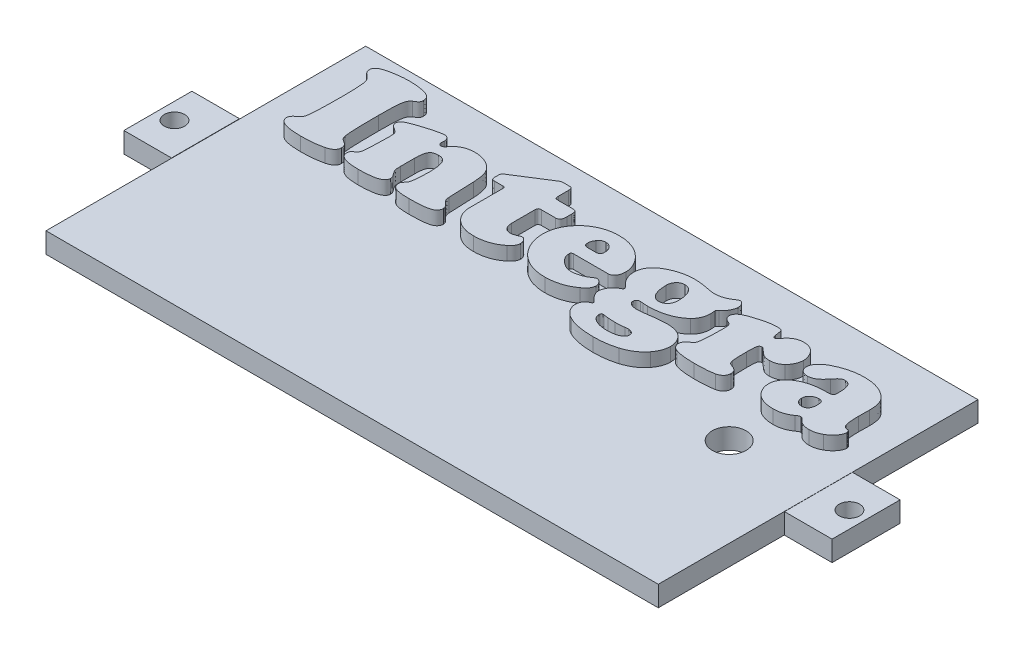
from build123d import *

# Parameters (mm, degrees)
CROQUIS1_W                = 90
CROQUIS1_H                = 47
SALIENTE_EXTRUIR1_DEPTH   = 3
CROQUIS1_W_2              = 7
CROQUIS1_H_2              = 10
SALIENTE_EXTRUIR1_2_DEPTH = 3
SALIENTE_EXTRUIR1_3_DEPTH = 3
CROQUIS2_R                = 2.5
CORTAR_EXTRUIR1_DEPTH     = 3
SALIENTE_EXTRUIR2_DEPTH   = 2
CROQUIS4_R                = 1.5
CORTAR_EXTRUIR2_DEPTH     = 3
CROQUIS5_R                = 1.5
CORTAR_EXTRUIR3_DEPTH     = 3


with BuildPart() as part:
    # Croquis1 → Saliente-Extruir1 (new body)
    with BuildSketch(Plane(origin=(0, 0, 0), x_dir=(1, 0, 0), z_dir=(0, 1, 0))):
        Rectangle(CROQUIS1_W, CROQUIS1_H)
    extrude(amount=SALIENTE_EXTRUIR1_DEPTH)

    # Croquis2 → Cortar-Extruir1 (cut)
    with BuildSketch(Plane(origin=(0, 3, 0), x_dir=(1, 0, 0), z_dir=(0, 1, 0))):
        with Locations(Location((31.921306653, 0.003005673, 0), (0, 0, 270))):
            Circle(CROQUIS2_R)
    extrude(amount=-CORTAR_EXTRUIR1_DEPTH, mode=Mode.SUBTRACT)

    # Croquis3 → Saliente-Extruir2 (add)
    # profile 1 of 7: a face of its own
    with BuildSketch(Plane(origin=(0, 3, 0), x_dir=(1, 0, 0), z_dir=(0, 1, 0))):
        with BuildLine():
            add(Edge.make_bspline(
                [(-35.337968672, 20.273194611), (-35.151013514, 20.271135758), (-34.781912751, 20.267071017), (-34.237655213, 20.223640995), (-33.708785467, 20.159050831), (-33.364481072, 20.093496178), (-33.193754145, 20.06099022)],
                knots=[0, 0, 0, 0, 1.039250674, 2.051765891, 3.033947791, 4, 4, 4, 4], degree=3))
            add(Edge.make_bspline(
                [(-33.193754145, 20.06099022), (-33.086565261, 20.03564344), (-32.88410387, 19.987767726), (-32.605073439, 19.887819007), (-32.370618441, 19.76224173), (-32.173058218, 19.62153286), (-32.020561131, 19.454109975), (-31.912995038, 19.264787414), (-31.847562874, 19.054859397), (-31.839262273, 18.907532475), (-31.835012591, 18.832105084)],
                knots=[0, 0, 0, 0, 1.320719494, 2.49461227, 3.542708864, 4.502637251, 5.390262006, 6.235311939, 7.096527548, 8, 8, 8, 8], degree=3))
            add(Edge.make_bspline(
                [(-31.835012591, 18.832105084), (-31.83550545, 18.78444644), (-31.836444642, 18.693628203), (-31.862614628, 18.567963581), (-31.900211826, 18.4591616), (-31.957913499, 18.362782209), (-32.051619435, 18.270573106), (-32.185962549, 18.169631477), (-32.363217217, 18.044894451), (-32.500557695, 17.96225636), (-32.576144348, 17.916775693)],
                knots=[0, 0, 0, 0, 0.909127826, 1.732432513, 2.441137461, 3.102262778, 3.858785696, 4.93682554, 6.314152492, 8, 8, 8, 8], degree=3))
            add(Edge.make_bspline(
                [(-32.576144348, 17.916775693), (-32.642894605, 17.866278984), (-32.784171551, 17.759402681), (-32.939173633, 17.512973232), (-33.051681711, 17.199549441), (-33.119483649, 16.888705078), (-33.159717354, 16.589326653), (-33.183233093, 16.306995465), (-33.205020351, 15.97543609), (-33.22465603, 15.594313938), (-33.235702952, 15.164492171), (-33.2454245, 14.6851803), (-33.251592418, 14.156232448), (-33.253128421, 13.786709559), (-33.25393151, 13.593507111)],
                knots=[0, 0, 0, 0, 0.665926642, 1.409434001, 2.287373552, 3.327534719, 3.950631411, 4.706302809, 5.596216287, 6.612275367, 7.762869607, 9.040067422, 10.452420036, 12, 12, 12, 12], degree=3))
            add(Edge.make_bspline(
                [(-33.25393151, 13.593507111), (-33.25294288, 13.270451298), (-33.251062525, 12.656005714), (-33.247355443, 11.782826893), (-33.230047287, 11.006866866), (-33.211338712, 10.328017752), (-33.191095769, 9.746084232), (-33.162514886, 9.26038657), (-33.131951696, 8.871054572), (-33.097635043, 8.645116998), (-33.082901104, 8.548110152)],
                knots=[0, 0, 0, 0, 1.534856011, 2.919264897, 4.148402202, 5.222214314, 6.14579697, 6.914547454, 7.533958314, 8, 8, 8, 8], degree=3))
            add(Edge.make_bspline(
                [(-33.082901104, 8.548110152), (-33.060790917, 8.455976087), (-33.020552595, 8.288301337), (-32.9190614, 8.099094298), (-32.808367793, 7.981869919), (-32.70370056, 7.896044056), (-32.577512122, 7.803874347), (-32.481641555, 7.746019917), (-32.43045178, 7.715128733)],
                knots=[0, 0, 0, 0, 1.545621008, 2.81287508, 3.4479107, 4.170480343, 5.02313397, 6, 6, 6, 6], degree=3))
            add(Edge.make_bspline(
                [(-32.43045178, 7.715128733), (-32.340337045, 7.660512706), (-32.16852009, 7.556379241), (-31.974574587, 7.333156955), (-31.855515104, 7.071252608), (-31.841958722, 6.883389349), (-31.835012591, 6.787130422)],
                knots=[0, 0, 0, 0, 1.083656221, 2.066149483, 3.009117719, 4, 4, 4, 4], degree=3))
            add(Edge.make_bspline(
                [(-31.835012591, 6.787130422), (-31.838076372, 6.717984618), (-31.844049401, 6.583180647), (-31.908485224, 6.391292737), (-32.008449827, 6.216742376), (-32.148472247, 6.059939093), (-32.325485302, 5.918525632), (-32.54454625, 5.800495112), (-32.800204267, 5.694701009), (-32.987188299, 5.642735555), (-33.086068334, 5.615255422)],
                knots=[0, 0, 0, 0, 0.890062822, 1.735231852, 2.58424183, 3.473155037, 4.43354919, 5.495703658, 6.675689534, 8, 8, 8, 8], degree=3))
            add(Edge.make_bspline(
                [(-33.086068334, 5.615255422), (-33.322959401, 5.562103673), (-33.819873377, 5.450610034), (-34.612371826, 5.348908262), (-35.48047786, 5.285141564), (-36.084249212, 5.277288404), (-36.398990631, 5.273194611)],
                knots=[0, 0, 0, 0, 0.872344012, 1.82987031, 2.868727875, 4, 4, 4, 4], degree=3))
            add(Edge.make_bspline(
                [(-36.398990631, 5.273194611), (-36.534141868, 5.274553629), (-36.795037032, 5.277177069), (-37.174214565, 5.293226805), (-37.527000862, 5.318205614), (-37.853870534, 5.351247152), (-38.153745923, 5.399933181), (-38.427728516, 5.455749152), (-38.677227164, 5.520862241), (-38.898365813, 5.60143708), (-39.097164073, 5.685234995), (-39.269849734, 5.782284878), (-39.412358335, 5.894822832), (-39.533838084, 6.012408465), (-39.626021339, 6.143929933), (-39.694559172, 6.284556274), (-39.733583303, 6.437715478), (-39.738099752, 6.543036507), (-39.740417996, 6.597096638)],
                knots=[0, 0, 0, 0, 1.651822637, 3.188668858, 4.637519228, 5.974115658, 7.202370546, 8.34873177, 9.391026865, 10.350132796, 11.222704322, 12.026134862, 12.761735533, 13.436911784, 14.084908757, 14.714002009, 15.339911301, 16, 16, 16, 16], degree=3))
            add(Edge.make_bspline(
                [(-39.740417996, 6.597096638), (-39.731801871, 6.676720979), (-39.71384952, 6.842624324), (-39.578539349, 7.077057959), (-39.373949338, 7.302735055), (-39.194638078, 7.426406061), (-39.097470361, 7.493422652)],
                knots=[0, 0, 0, 0, 0.829923195, 1.729207842, 2.769471094, 4, 4, 4, 4], degree=3))
            add(Edge.make_bspline(
                [(-39.097470361, 7.493422652), (-39.020566555, 7.548222354), (-38.870661933, 7.655040586), (-38.699795506, 7.867793793), (-38.567191989, 8.103140147), (-38.530312002, 8.27835789), (-38.511532861, 8.367578057)],
                knots=[0, 0, 0, 0, 1.040718252, 2.028618403, 2.996180443, 4, 4, 4, 4], degree=3))
            add(Edge.make_bspline(
                [(-38.511532861, 8.367578057), (-38.495737481, 8.482542494), (-38.460175557, 8.741374926), (-38.426757702, 9.173930773), (-38.389269439, 9.692075902), (-38.36818096, 10.295313135), (-38.343165238, 10.983536418), (-38.333991905, 11.756507349), (-38.322666007, 12.614800176), (-38.321900161, 13.215545177), (-38.321499077, 13.530162517)],
                knots=[0, 0, 0, 0, 0.538662664, 1.21275215, 2.01352922, 2.950554537, 4.014753711, 5.210903361, 6.539316743, 8, 8, 8, 8], degree=3))
            add(Edge.make_bspline(
                [(-38.321499077, 13.530162517), (-38.322141521, 13.747646616), (-38.323364102, 14.161523079), (-38.331512162, 14.751805793), (-38.350995274, 15.280778741), (-38.375518224, 15.749655003), (-38.406429105, 16.15740598), (-38.443062743, 16.504169667), (-38.487392365, 16.789302158), (-38.530514744, 16.95628245), (-38.549539618, 17.029951368)],
                knots=[0, 0, 0, 0, 1.485140821, 2.826251821, 4.030987823, 5.099527266, 6.032321808, 6.822887276, 7.480677507, 8, 8, 8, 8], degree=3))
            add(Edge.make_bspline(
                [(-38.549539618, 17.029951368), (-38.574174482, 17.102004763), (-38.624679559, 17.249724767), (-38.757836066, 17.452716286), (-38.925700581, 17.648580869), (-39.06379862, 17.760500653), (-39.135477118, 17.818591571)],
                knots=[0, 0, 0, 0, 0.911581787, 1.868876074, 2.89386003, 4, 4, 4, 4], degree=3))
            add(Edge.make_bspline(
                [(-39.135477118, 17.818591571), (-39.190617276, 17.864748276), (-39.292749437, 17.950241032), (-39.431504209, 18.073529284), (-39.53919524, 18.186288245), (-39.646950962, 18.323923755), (-39.724131235, 18.528299242), (-39.734744724, 18.699446847), (-39.740417996, 18.790931098)],
                knots=[0, 0, 0, 0, 1.082208101, 2.004496488, 2.791201693, 3.426696171, 4.624481046, 6, 6, 6, 6], degree=3))
            add(Edge.make_bspline(
                [(-39.740417996, 18.790931098), (-39.736291026, 18.864648037), (-39.728247291, 19.008327184), (-39.642303756, 19.209068841), (-39.508917844, 19.38461382), (-39.315945226, 19.535034126), (-39.05976121, 19.667498426), (-38.732064283, 19.791475089), (-38.32589822, 19.907507216), (-38.027398976, 19.972097382), (-37.865417996, 20.007147314)],
                knots=[0, 0, 0, 0, 0.726640458, 1.416269873, 2.125534284, 2.891758334, 3.81848234, 4.974357587, 6.358131447, 8, 8, 8, 8], degree=3))
            add(Edge.make_bspline(
                [(-37.865417996, 20.007147314), (-37.656802015, 20.048749429), (-37.240332423, 20.131801626), (-36.608515105, 20.210778681), (-35.974484812, 20.26508157), (-35.550289685, 20.270488365), (-35.337968672, 20.273194611)],
                knots=[0, 0, 0, 0, 1.002350968, 2.001038921, 2.999466488, 4, 4, 4, 4], degree=3))
        make_face()
    # profile 2 of 7: a face of its own
    with BuildSketch(Plane(origin=(0, 3, 0), x_dir=(1, 0, 0), z_dir=(0, 1, 0))):
        with BuildLine():
            Line((-17.797850429, 12.155584814), (-17.645823402, 8.411919274))
            add(Edge.make_bspline(
                [(-17.645823402, 8.411919274), (-17.642211718, 8.3452023), (-17.635461539, 8.220509364), (-17.601440387, 8.048373003), (-17.564126029, 7.902264026), (-17.503173225, 7.771488537), (-17.400509734, 7.638169077), (-17.254850131, 7.466948947), (-17.045591408, 7.254275616), (-16.88981684, 7.094414451), (-16.803340294, 7.005669274)],
                knots=[0, 0, 0, 0, 0.943018908, 1.762486983, 2.47576604, 3.069826988, 3.786220816, 4.844710638, 6.248375628, 8, 8, 8, 8], degree=3))
            add(Edge.make_bspline(
                [(-16.803340294, 7.005669274), (-16.776330111, 6.976226347), (-16.721400563, 6.916349424), (-16.668377637, 6.800874809), (-16.636363403, 6.669620667), (-16.633700227, 6.576192643), (-16.632309888, 6.527417584)],
                knots=[0, 0, 0, 0, 0.913373708, 1.857492231, 2.881481818, 4, 4, 4, 4], degree=3))
            add(Edge.make_bspline(
                [(-16.632309888, 6.527417584), (-16.634660775, 6.471264754), (-16.639243004, 6.361814488), (-16.677586617, 6.203246351), (-16.745953603, 6.059124962), (-16.83816517, 5.927206117), (-16.959813098, 5.812534426), (-17.102096398, 5.706871396), (-17.273820793, 5.618618867), (-17.472342603, 5.542224698), (-17.705355205, 5.480288717), (-17.974731072, 5.423134608), (-18.285747292, 5.376723812), (-18.637785809, 5.340327241), (-19.030540756, 5.308008516), (-19.46361542, 5.286932668), (-19.937760861, 5.274047501), (-20.26722447, 5.273487256), (-20.439320023, 5.273194611)],
                knots=[0, 0, 0, 0, 0.614740939, 1.198222052, 1.772575782, 2.353414357, 2.950492971, 3.595912666, 4.289197211, 5.058140028, 5.922422319, 6.92733337, 8.074001065, 9.365306715, 10.804145945, 12.390753952, 14.11470773, 16, 16, 16, 16], degree=3))
            add(Edge.make_bspline(
                [(-20.439320023, 5.273194611), (-20.556525963, 5.273405582), (-20.781513068, 5.273810557), (-21.105659665, 5.287861053), (-21.40266336, 5.305037791), (-21.674246483, 5.333710479), (-21.918454249, 5.370694094), (-22.13599214, 5.415762105), (-22.327756395, 5.463717228), (-22.443476549, 5.508590118), (-22.498019348, 5.52974022)],
                knots=[0, 0, 0, 0, 1.348466818, 2.588500613, 3.732722968, 4.771062755, 5.72974341, 6.573123183, 7.327464984, 8, 8, 8, 8], degree=3))
            add(Edge.make_bspline(
                [(-22.498019348, 5.52974022), (-22.592265958, 5.576319777), (-22.769330362, 5.66383042), (-22.973701648, 5.870469796), (-23.099868117, 6.122234346), (-23.112383795, 6.306379237), (-23.118796375, 6.400728395)],
                knots=[0, 0, 0, 0, 1.101920216, 2.070216049, 3.011248745, 4, 4, 4, 4], degree=3))
            add(Edge.make_bspline(
                [(-23.118796375, 6.400728395), (-23.116246006, 6.46214918), (-23.111811324, 6.568950064), (-23.075110967, 6.701122802), (-23.007938418, 6.798294613), (-22.92947232, 6.904517724), (-22.817247231, 7.047189215), (-22.732412351, 7.154556702), (-22.684885902, 7.214706436)],
                knots=[0, 0, 0, 0, 1.167663166, 2.030378784, 2.553420409, 3.399894669, 4.54336125, 6, 6, 6, 6], degree=3))
            add(Edge.make_bspline(
                [(-22.684885902, 7.214706436), (-22.653186495, 7.262208832), (-22.579594049, 7.372489051), (-22.51265223, 7.591174207), (-22.444005479, 7.867244938), (-22.398481147, 8.211631539), (-22.357640424, 8.620275938), (-22.325535188, 9.094546517), (-22.312347296, 9.63439024), (-22.309494611, 10.015589129), (-22.307985564, 10.21724022)],
                knots=[0, 0, 0, 0, 0.44654582, 1.036688133, 1.778823771, 2.684150114, 3.759255125, 5.005838266, 6.416112961, 8, 8, 8, 8], degree=3))
            add(Edge.make_bspline(
                [(-22.307985564, 10.21724022), (-22.309436817, 10.336552068), (-22.312250723, 10.567891664), (-22.327118994, 10.902914194), (-22.355315934, 11.213671025), (-22.395428011, 11.499377199), (-22.450346266, 11.760149297), (-22.511658304, 11.998019594), (-22.587650131, 12.211901881), (-22.649054051, 12.342877512), (-22.678551442, 12.405795963)],
                knots=[0, 0, 0, 0, 1.279185315, 2.480275141, 3.594151077, 4.623383609, 5.571232112, 6.449780193, 7.255300946, 8, 8, 8, 8], degree=3))
            add(Edge.make_bspline(
                [(-22.678551442, 12.405795963), (-22.704517857, 12.451167211), (-22.756199383, 12.541470605), (-22.858993617, 12.657254466), (-22.973989531, 12.758167707), (-23.107396276, 12.838138716), (-23.255582453, 12.900803107), (-23.420585152, 12.945895868), (-23.60056274, 12.969845412), (-23.72578354, 12.973840555), (-23.790249077, 12.975897314)],
                knots=[0, 0, 0, 0, 0.948924403, 1.888665135, 2.801311401, 3.723811356, 4.705047962, 5.72102276, 6.826748501, 8, 8, 8, 8], degree=3))
            add(Edge.make_bspline(
                [(-23.790249077, 12.975897314), (-23.910037866, 12.971196986), (-24.13317585, 12.962441395), (-24.44118647, 12.879468607), (-24.686878908, 12.728038825), (-24.84258055, 12.553475022), (-24.928099853, 12.382190299), (-24.990499026, 12.232980778), (-25.034311631, 12.057363308), (-25.076990736, 11.860227972), (-25.107477662, 11.638909802), (-25.128074052, 11.394667961), (-25.146122847, 11.127545891), (-25.145926141, 10.941515519), (-25.145823402, 10.844351706)],
                knots=[0, 0, 0, 0, 1.472587996, 2.743080712, 3.874980013, 4.979717016, 5.566599563, 6.225160936, 6.965739901, 7.788672511, 8.707247665, 9.711649847, 10.804792875, 12, 12, 12, 12], degree=3))
            Line((-25.145823402, 10.844351706), (-25.145823402, 8.722307787))
            add(Edge.make_bspline(
                [(-25.145823402, 8.722307787), (-25.144469445, 8.625172954), (-25.141994849, 8.447641832), (-25.128238505, 8.205112649), (-25.100915095, 8.012313982), (-25.061313912, 7.847982445), (-24.977916275, 7.685835514), (-24.852029742, 7.488102676), (-24.676302159, 7.234390325), (-24.540320901, 7.048588003), (-24.46486901, 6.945491909)],
                knots=[0, 0, 0, 0, 1.188138779, 2.171534194, 2.967662019, 3.568983228, 4.227343203, 5.184014885, 6.437494933, 8, 8, 8, 8], degree=3))
            add(Edge.make_bspline(
                [(-24.46486901, 6.945491909), (-24.426606508, 6.878518156), (-24.348668864, 6.742098), (-24.339619357, 6.585145585), (-24.335012591, 6.505246976)],
                knots=[0, 0, 0, 0, 0.981874739, 2, 2, 2, 2], degree=3))
            add(Edge.make_bspline(
                [(-24.335012591, 6.505246976), (-24.337049724, 6.45424874), (-24.341067899, 6.353656466), (-24.385194737, 6.208971675), (-24.452247154, 6.073032313), (-24.548946813, 5.948024462), (-24.675497608, 5.83751646), (-24.825834255, 5.736182849), (-25.001495609, 5.643311916), (-25.20637189, 5.56575928), (-25.438251956, 5.496392835), (-25.699630654, 5.436658531), (-25.991476256, 5.386350155), (-26.314071396, 5.347315991), (-26.66649183, 5.310102737), (-27.049206814, 5.291549744), (-27.461946341, 5.272836697), (-27.747147523, 5.273072424), (-27.894978807, 5.273194611)],
                knots=[0, 0, 0, 0, 0.597049907, 1.177660499, 1.759724767, 2.369632357, 3.019188821, 3.723994663, 4.494716329, 5.346410437, 6.291486589, 7.334852324, 8.492362679, 9.766938745, 11.1495871, 12.651959306, 14.264575369, 16, 16, 16, 16], degree=3))
            add(Edge.make_bspline(
                [(-27.894978807, 5.273194611), (-28.0132192, 5.2750065), (-28.242372686, 5.278517995), (-28.574308619, 5.288493111), (-28.882407485, 5.316364708), (-29.168284028, 5.345088536), (-29.431299018, 5.390305951), (-29.672512227, 5.44349693), (-29.890913945, 5.505751973), (-30.08583897, 5.578806797), (-30.258087978, 5.660704433), (-30.408016635, 5.75273984), (-30.53666516, 5.853040007), (-30.639168679, 5.967014616), (-30.723622, 6.086730932), (-30.782349454, 6.220035863), (-30.812621254, 6.363485323), (-30.81851721, 6.46183918), (-30.821499077, 6.511581436)],
                knots=[0, 0, 0, 0, 1.626457141, 3.152123511, 4.565308896, 5.880116765, 7.10226897, 8.23302984, 9.276121079, 10.222684753, 11.092893677, 11.894766118, 12.638533766, 13.327106936, 13.995640627, 14.645789116, 15.315110708, 16, 16, 16, 16], degree=3))
            add(Edge.make_bspline(
                [(-30.821499077, 6.511581436), (-30.818817043, 6.588225776), (-30.814055793, 6.724287709), (-30.753036485, 6.885395988), (-30.667246097, 6.990566972), (-30.569701906, 7.076136303), (-30.447115812, 7.182209424), (-30.351239155, 7.252404766), (-30.298906172, 7.290719949)],
                knots=[0, 0, 0, 0, 1.388672287, 2.465223578, 3.052840369, 3.840603126, 4.821322274, 6, 6, 6, 6], degree=3))
            add(Edge.make_bspline(
                [(-30.298906172, 7.290719949), (-30.25554064, 7.324257142), (-30.171894753, 7.38894557), (-30.069409811, 7.503352494), (-29.995429788, 7.626714477), (-29.93740281, 7.770124755), (-29.90223192, 7.968530524), (-29.870015208, 8.246657481), (-29.834939829, 8.620536339), (-29.817615759, 8.901725328), (-29.807985564, 9.058034138)],
                knots=[0, 0, 0, 0, 0.689906937, 1.330731431, 1.921692203, 2.494863055, 3.269836891, 4.449734915, 6.02646002, 8, 8, 8, 8], degree=3))
            add(Edge.make_bspline(
                [(-29.807985564, 9.058034138), (-29.787131827, 9.478136943), (-29.744498811, 10.336987793), (-29.738303953, 11.196879412), (-29.73513928, 11.636159138)],
                knots=[0, 0, 0, 0, 0.97829048, 2, 2, 2, 2], degree=3))
            add(Edge.make_bspline(
                [(-29.73513928, 11.636159138), (-29.735932763, 11.749127018), (-29.737373385, 11.954228029), (-29.756844803, 12.230095582), (-29.793930714, 12.442055353), (-29.843154761, 12.61036342), (-29.944314296, 12.747760404), (-30.090277235, 12.882437787), (-30.293872398, 13.026873268), (-30.450274464, 13.122657745), (-30.536448402, 13.175432787)],
                knots=[0, 0, 0, 0, 1.440284036, 2.614935437, 3.517742138, 4.185927533, 4.824308273, 5.661969329, 6.711798915, 8, 8, 8, 8], degree=3))
            add(Edge.make_bspline(
                [(-30.536448402, 13.175432787), (-30.609499873, 13.224299481), (-30.745481276, 13.315262215), (-30.904992385, 13.487377034), (-31.005280332, 13.681089048), (-31.017925808, 13.819410365), (-31.02420178, 13.888059476)],
                knots=[0, 0, 0, 0, 1.164875323, 2.168353035, 3.090950412, 4, 4, 4, 4], degree=3))
            add(Edge.make_bspline(
                [(-31.02420178, 13.888059476), (-31.020503521, 13.953191373), (-31.013237317, 14.081160169), (-30.938003157, 14.260885011), (-30.820317748, 14.421108809), (-30.682512297, 14.533093488), (-30.545614306, 14.618382397), (-30.417640142, 14.691273948), (-30.261257184, 14.763018832), (-30.08529963, 14.845428973), (-29.881560007, 14.927723602), (-29.655782586, 15.015785168), (-29.404623003, 15.108127344), (-29.228519263, 15.168012201), (-29.136532861, 15.199292584)],
                knots=[0, 0, 0, 0, 0.954732132, 1.875823151, 2.821266671, 3.858534407, 4.46674864, 5.197731176, 6.025357224, 6.999518125, 8.059268852, 9.260496366, 10.569041857, 12, 12, 12, 12], degree=3))
            add(Edge.make_bspline(
                [(-29.136532861, 15.199292584), (-28.805926532, 15.307827848), (-28.161107847, 15.519516371), (-27.362432424, 15.736417216), (-26.778575007, 15.880303496), (-26.419249946, 15.953014178), (-26.134228801, 16.002530284), (-25.967313648, 16.012293354), (-25.896456848, 16.016437855)],
                knots=[0, 0, 0, 0, 1.870183004, 3.647628121, 4.447360987, 5.10180177, 5.618707758, 6, 6, 6, 6], degree=3))
            add(Edge.make_bspline(
                [(-25.896456848, 16.016437855), (-25.845536068, 16.013004167), (-25.746205147, 16.00630609), (-25.602358312, 15.964939627), (-25.473597002, 15.889350226), (-25.361001822, 15.787985564), (-25.266952604, 15.668877278), (-25.194632153, 15.536901063), (-25.152199959, 15.391902917), (-25.14796861, 15.291412943), (-25.145823402, 15.240466571)],
                knots=[0, 0, 0, 0, 1.020294183, 1.990282975, 2.965785723, 3.984106626, 5.007681154, 5.991396885, 6.981679097, 8, 8, 8, 8], degree=3))
            add(Edge.make_bspline(
                [(-25.145823402, 15.240466571), (-25.145713668, 15.230961524), (-25.145396301, 15.203471463), (-25.150080819, 15.150774645), (-25.152443933, 15.072612608), (-25.154268781, 15.012425613), (-25.155325091, 14.977586503)],
                knots=[0, 0, 0, 0, 0.433393662, 1.253441231, 2.410160454, 4, 4, 4, 4], degree=3))
            add(Edge.make_bspline(
                [(-25.155325091, 14.977586503), (-25.157686511, 14.952264754), (-25.162207316, 14.903787696), (-25.163980033, 14.85513374), (-25.16482678, 14.831893936)],
                knots=[0, 0, 0, 0, 1.044690016, 2, 2, 2, 2], degree=3))
            add(Edge.make_bspline(
                [(-25.16482678, 14.831893936), (-25.1606268, 14.757096076), (-25.153153238, 14.623998644), (-25.071172551, 14.447396341), (-24.916943937, 14.341135461), (-24.795916415, 14.33278772), (-24.730916307, 14.328304409)],
                knots=[0, 0, 0, 0, 1.181964001, 2.103220236, 2.981298746, 4, 4, 4, 4], degree=3))
            add(Edge.make_bspline(
                [(-24.730916307, 14.328304409), (-24.685739707, 14.334001991), (-24.58903652, 14.346198002), (-24.449067535, 14.428279025), (-24.308848153, 14.556063593), (-24.223529113, 14.664582885), (-24.176651104, 14.724208125)],
                knots=[0, 0, 0, 0, 0.770303879, 1.64888105, 2.708192531, 4, 4, 4, 4], degree=3))
            add(Edge.make_bspline(
                [(-24.176651104, 14.724208125), (-24.096968345, 14.827894454), (-23.939826429, 15.032373671), (-23.660527312, 15.295348143), (-23.358017767, 15.519777204), (-23.02733277, 15.701609189), (-22.671236344, 15.844753076), (-22.287253968, 15.945781461), (-21.877109365, 16.006906243), (-21.594520379, 16.013207734), (-21.449666307, 16.016437855)],
                knots=[0, 0, 0, 0, 0.997447741, 1.967061001, 2.918633841, 3.867914679, 4.841242882, 5.842724412, 6.894188493, 8, 8, 8, 8], degree=3))
            add(Edge.make_bspline(
                [(-21.449666307, 16.016437855), (-21.3376503, 16.015221487), (-21.116213409, 16.012816933), (-20.791563473, 15.975548534), (-20.478119585, 15.92241891), (-20.176474693, 15.847644688), (-19.888428588, 15.744617218), (-19.610797607, 15.623764026), (-19.344184486, 15.483383676), (-19.178796605, 15.369860377), (-19.096414618, 15.313312855)],
                knots=[0, 0, 0, 0, 1.076097874, 2.127265324, 3.136601985, 4.13093138, 5.109813131, 6.073213324, 7.04024095, 8, 8, 8, 8], degree=3))
            add(Edge.make_bspline(
                [(-19.096414618, 15.313312855), (-18.988209147, 15.229692179), (-18.776995562, 15.06646732), (-18.511439334, 14.777733187), (-18.290827034, 14.472430038), (-18.123773009, 14.131578554), (-18.000391574, 13.740546665), (-17.904003972, 13.282342959), (-17.837548729, 12.745071198), (-17.811654356, 12.360561529), (-17.797850429, 12.155584814)],
                knots=[0, 0, 0, 0, 0.921632586, 1.798997051, 2.637405773, 3.45650997, 4.348969367, 5.398723485, 6.613295954, 8, 8, 8, 8], degree=3))
        make_face()
    # profile 3 of 7: a face of its own
    with BuildSketch(Plane(origin=(0, 3, 0), x_dir=(1, 0, 0), z_dir=(0, 1, 0))):
        with BuildLine():
            Line((-9.740417996, 13.099419274), (-9.740417996, 9.688312855))
            add(Edge.make_bspline(
                [(-9.740417996, 9.688312855), (-9.737541548, 9.59078848), (-9.732038963, 9.404226464), (-9.668799689, 9.139121266), (-9.571788914, 8.900380765), (-9.431701968, 8.694093774), (-9.261530839, 8.526142244), (-9.066719185, 8.399353503), (-8.845496937, 8.329275656), (-8.691463763, 8.318984933), (-8.612884213, 8.313735152)],
                knots=[0, 0, 0, 0, 1.175068366, 2.247880309, 3.270455911, 4.270868795, 5.235233746, 6.140426796, 7.051344444, 8, 8, 8, 8], degree=3))
            add(Edge.make_bspline(
                [(-8.612884213, 8.313735152), (-8.537536179, 8.317522827), (-8.372933609, 8.325797244), (-8.113772787, 8.398708377), (-7.817140027, 8.49319433), (-7.615321456, 8.586795806), (-7.507521037, 8.636792584)],
                knots=[0, 0, 0, 0, 0.778533748, 1.700756467, 2.77187012, 4, 4, 4, 4], degree=3))
            add(Edge.make_bspline(
                [(-7.507521037, 8.636792584), (-7.454606191, 8.661612773), (-7.352089299, 8.709699252), (-7.239122003, 8.716061992), (-7.184463604, 8.719140557)],
                knots=[0, 0, 0, 0, 1.03231466, 2, 2, 2, 2], degree=3))
            add(Edge.make_bspline(
                [(-7.184463604, 8.719140557), (-7.141553128, 8.71545752), (-7.054034646, 8.707945746), (-6.930729339, 8.64459481), (-6.812970326, 8.549084495), (-6.709046645, 8.418199405), (-6.613018101, 8.270284706), (-6.54845281, 8.107346958), (-6.503041347, 7.939296845), (-6.499148718, 7.824180353), (-6.497174753, 7.765804409)],
                knots=[0, 0, 0, 0, 0.801142035, 1.633977097, 2.549607344, 3.632488577, 4.753639615, 5.846079316, 6.907739873, 8, 8, 8, 8], degree=3))
            add(Edge.make_bspline(
                [(-6.497174753, 7.765804409), (-6.50702613, 7.657730867), (-6.52720269, 7.436385956), (-6.678124741, 7.1152576), (-6.913971214, 6.804665336), (-7.123437158, 6.625909908), (-7.23513928, 6.530584814)],
                knots=[0, 0, 0, 0, 0.870419241, 1.78270155, 2.81757894, 4, 4, 4, 4], degree=3))
            add(Edge.make_bspline(
                [(-7.23513928, 6.530584814), (-7.365413849, 6.430021565), (-7.624473221, 6.230045065), (-8.041426471, 5.973504288), (-8.478458964, 5.756954774), (-8.935879608, 5.578252119), (-9.415793134, 5.443202443), (-9.914646074, 5.345563559), (-10.43349367, 5.282706589), (-10.78647537, 5.276403007), (-10.966135902, 5.273194611)],
                knots=[0, 0, 0, 0, 0.982571262, 1.953906256, 2.918482018, 3.892883166, 4.883035114, 5.892283756, 6.927215149, 8, 8, 8, 8], degree=3))
            add(Edge.make_bspline(
                [(-10.966135902, 5.273194611), (-11.107696396, 5.276661951), (-11.384029706, 5.283430376), (-11.787827214, 5.323730585), (-12.169857063, 5.395552054), (-12.528915255, 5.502567412), (-12.870163783, 5.630013281), (-13.187919046, 5.793048069), (-13.484365028, 5.984762716), (-13.759720824, 6.201556376), (-14.005100671, 6.444617225), (-14.221216073, 6.706875581), (-14.400601251, 6.989804422), (-14.552137991, 7.289034568), (-14.66566886, 7.608736705), (-14.74714968, 7.945208271), (-14.800497857, 8.300430385), (-14.805446969, 8.543688313), (-14.807985564, 8.668464882)],
                knots=[0, 0, 0, 0, 1.177435413, 2.298414033, 3.371280156, 4.40494668, 5.411096227, 6.396768815, 7.368576861, 8.343592791, 9.30599345, 10.235796752, 11.16381552, 12.086627095, 13.019865311, 13.978211711, 14.96294519, 16, 16, 16, 16], degree=3))
            Line((-14.807985564, 8.668464882), (-14.807985564, 13.435145625))
            add(Edge.make_bspline(
                [(-14.807985564, 13.435145625), (-14.808104324, 13.471096749), (-14.808318382, 13.535896418), (-14.820702018, 13.621033969), (-14.838285589, 13.685450466), (-14.868085167, 13.732382856), (-14.918245794, 13.760106634), (-14.986245547, 13.777669433), (-15.079171667, 13.785082492), (-15.148995022, 13.786124976), (-15.188053131, 13.786708125)],
                knots=[0, 0, 0, 0, 1.358424303, 2.448475509, 3.244202367, 3.875652076, 4.485254555, 5.357478395, 6.521814129, 8, 8, 8, 8], degree=3))
            Line((-15.188053131, 13.786708125), (-16.334590294, 13.786708125))
            add(Edge.make_bspline(
                [(-16.334590294, 13.786708125), (-16.383152707, 13.787820496), (-16.471249096, 13.789838433), (-16.59109835, 13.805999783), (-16.680983282, 13.840861308), (-16.752913093, 13.887532912), (-16.791039965, 13.970605966), (-16.817477913, 14.077375433), (-16.831466293, 14.220357524), (-16.833741638, 14.326195826), (-16.835012591, 14.385314544)],
                knots=[0, 0, 0, 0, 1.23705947, 2.244132139, 3.052384418, 3.686473456, 4.359763929, 5.304711032, 6.494476732, 8, 8, 8, 8], degree=3))
            Line((-16.835012591, 14.385314544), (-16.835012591, 14.873067922))
            add(Edge.make_bspline(
                [(-16.835012591, 14.873067922), (-16.831465073, 14.925394162), (-16.824687779, 15.025359931), (-16.770614608, 15.160865185), (-16.694254547, 15.27937046), (-16.619636566, 15.333336712), (-16.581634213, 15.360821301)],
                knots=[0, 0, 0, 0, 1.092203878, 2.086582169, 3.025511284, 4, 4, 4, 4], degree=3))
            Line((-16.581634213, 15.360821301), (-11.552073402, 18.553388868))
            add(Edge.make_bspline(
                [(-11.552073402, 18.553388868), (-11.48326845, 18.581614589), (-11.336295327, 18.641907086), (-11.177356999, 18.648217026), (-11.092825091, 18.65157299)],
                knots=[0, 0, 0, 0, 0.936292976, 2, 2, 2, 2], degree=3))
            Line((-11.092825091, 18.65157299), (-10.202833537, 18.65157299))
            add(Edge.make_bspline(
                [(-10.202833537, 18.65157299), (-10.16038635, 18.651261688), (-10.081950857, 18.650686453), (-9.977186877, 18.624545706), (-9.891410104, 18.587955934), (-9.829746448, 18.525054087), (-9.788968478, 18.439421757), (-9.756286014, 18.328624951), (-9.744855901, 18.18618007), (-9.741981802, 18.081447057), (-9.740417996, 18.024461503)],
                knots=[0, 0, 0, 0, 1.10435238, 2.040663418, 2.805323923, 3.507252611, 4.284243168, 5.261481085, 6.509963472, 8, 8, 8, 8], degree=3))
            Line((-9.740417996, 18.024461503), (-9.740417996, 16.54219799))
            add(Edge.make_bspline(
                [(-9.740417996, 16.54219799), (-9.739219297, 16.492574412), (-9.737015141, 16.40132704), (-9.721441977, 16.27741204), (-9.686349168, 16.182969807), (-9.639473424, 16.109972295), (-9.564193122, 16.062467826), (-9.462901022, 16.038666128), (-9.335789646, 16.018644698), (-9.241171855, 16.017219101), (-9.189320023, 16.016437855)],
                knots=[0, 0, 0, 0, 1.302495851, 2.395017239, 3.253779948, 3.929720919, 4.62852488, 5.522281972, 6.642176934, 8, 8, 8, 8], degree=3))
            Line((-9.189320023, 16.016437855), (-7.146456848, 16.016437855))
            add(Edge.make_bspline(
                [(-7.146456848, 16.016437855), (-7.085141572, 16.014816613), (-6.972267269, 16.011832096), (-6.820324149, 15.986469261), (-6.702346273, 15.938729475), (-6.612616468, 15.867192633), (-6.558496111, 15.75719312), (-6.523182543, 15.613039797), (-6.498021354, 15.427086108), (-6.497474263, 15.288068048), (-6.497174753, 15.211961503)],
                knots=[0, 0, 0, 0, 1.190807188, 2.192137743, 2.972897245, 3.642337585, 4.367254584, 5.302369413, 6.523160632, 8, 8, 8, 8], degree=3))
            Line((-6.497174753, 15.211961503), (-6.497174753, 14.54684326))
            add(Edge.make_bspline(
                [(-6.497174753, 14.54684326), (-6.498825116, 14.463392871), (-6.501866021, 14.309629895), (-6.527383938, 14.098083853), (-6.577870196, 13.928382957), (-6.643426368, 13.792514757), (-6.742827484, 13.6918802), (-6.875677404, 13.631936129), (-7.033899244, 13.588268592), (-7.15029721, 13.585497464), (-7.212968672, 13.584005422)],
                knots=[0, 0, 0, 0, 1.431634073, 2.637882421, 3.640435227, 4.458548652, 5.201234269, 6.011088797, 6.929122402, 8, 8, 8, 8], degree=3))
            Line((-7.212968672, 13.584005422), (-9.211490631, 13.584005422))
            add(Edge.make_bspline(
                [(-9.211490631, 13.584005422), (-9.259102928, 13.583180394), (-9.34529238, 13.5816869), (-9.463490478, 13.562062537), (-9.55840055, 13.533699195), (-9.633069988, 13.486651397), (-9.681605616, 13.417663878), (-9.717023764, 13.331395269), (-9.738369918, 13.222877514), (-9.739698275, 13.142804087), (-9.740417996, 13.099419274)],
                knots=[0, 0, 0, 0, 1.347648459, 2.439560632, 3.38565748, 4.140758942, 4.888714174, 5.733340777, 6.771894863, 8, 8, 8, 8], degree=3))
        make_face()
    # profile 4 of 7: a face of its own
    with BuildSketch(Plane(origin=(0, 3, 0), x_dir=(1, 0, 0), z_dir=(0, 1, 0))):
        with BuildLine():
            Line((3.802656328, 10.340762179), (-1.296583537, 10.340762179))
            add(Edge.make_bspline(
                [(-1.296583537, 10.340762179), (-1.34602329, 10.338533627), (-1.436045577, 10.334475772), (-1.552872882, 10.269969779), (-1.623307845, 10.15850056), (-1.629126744, 10.071585062), (-1.632309888, 10.024039206)],
                knots=[0, 0, 0, 0, 1.118405153, 2.036446046, 2.925866451, 4, 4, 4, 4], degree=3))
            add(Edge.make_bspline(
                [(-1.632309888, 10.024039206), (-1.623313264, 9.896948654), (-1.605026196, 9.638616938), (-1.444744357, 9.264954409), (-1.197553621, 8.905093269), (-0.86486029, 8.573027727), (-0.482513518, 8.282646067), (-0.070064467, 8.066648441), (0.359909094, 7.93111992), (0.653481309, 7.915921471), (0.800122544, 7.908329747)],
                knots=[0, 0, 0, 0, 0.864638396, 1.757514756, 2.733239288, 3.834326856, 4.951694748, 5.999581231, 7.000777785, 8, 8, 8, 8], degree=3))
            add(Edge.make_bspline(
                [(0.800122544, 7.908329747), (0.890009359, 7.910696465), (1.07595189, 7.915592328), (1.360684189, 7.960036131), (1.659908155, 8.027255762), (1.967156023, 8.116999781), (2.267785567, 8.22819119), (2.546410086, 8.355524142), (2.799800256, 8.489436167), (2.950568849, 8.595146582), (3.023517814, 8.646294274)],
                knots=[0, 0, 0, 0, 0.90779832, 1.877898526, 2.905427032, 4.005956633, 5.109738961, 6.140971281, 7.100514104, 8, 8, 8, 8], degree=3))
            add(Edge.make_bspline(
                [(3.023517814, 8.646294274), (3.081751384, 8.68794919), (3.188881108, 8.764579898), (3.348163158, 8.848274499), (3.485506695, 8.911719046), (3.575157633, 8.918685763), (3.615789774, 8.92184326)],
                knots=[0, 0, 0, 0, 1.294819544, 2.382022262, 3.266690342, 4, 4, 4, 4], degree=3))
            add(Edge.make_bspline(
                [(3.615789774, 8.92184326), (3.664069515, 8.918558857), (3.763749166, 8.911777791), (3.905699372, 8.839416303), (4.048408296, 8.737425807), (4.176105633, 8.592731725), (4.296118504, 8.435450329), (4.380849699, 8.265282595), (4.441505987, 8.094008066), (4.446355768, 7.976403946), (4.448771193, 7.917831436)],
                knots=[0, 0, 0, 0, 0.814542636, 1.681726613, 2.65788588, 3.787672486, 4.943237008, 6.010456478, 7.009111597, 8, 8, 8, 8], degree=3))
            add(Edge.make_bspline(
                [(4.448771193, 7.917831436), (4.445452828, 7.856351495), (4.438788795, 7.732885745), (4.392333978, 7.548671201), (4.314153727, 7.367532731), (4.20940462, 7.185624772), (4.071218779, 7.007541856), (3.900989388, 6.834175754), (3.704335201, 6.659216231), (3.558572699, 6.549590838), (3.482766125, 6.492578057)],
                knots=[0, 0, 0, 0, 0.82531494, 1.657420713, 2.534218898, 3.467964772, 4.468924267, 5.551771359, 6.726751917, 8, 8, 8, 8], degree=3))
            add(Edge.make_bspline(
                [(3.482766125, 6.492578057), (3.339761197, 6.394921367), (3.054648299, 6.200220512), (2.598668906, 5.955859691), (2.131241813, 5.741677018), (1.644683814, 5.56938272), (1.142264328, 5.437500851), (0.623527542, 5.342443328), (0.08885478, 5.283680828), (-0.273416927, 5.27672477), (-0.457267659, 5.273194611)],
                knots=[0, 0, 0, 0, 0.990566295, 1.974919532, 2.956672389, 3.931463233, 4.925268486, 5.926833671, 6.947880448, 8, 8, 8, 8], degree=3))
            add(Edge.make_bspline(
                [(-0.457267659, 5.273194611), (-0.64113073, 5.27649811), (-1.002493018, 5.282990766), (-1.533368233, 5.344451607), (-2.041503958, 5.446234288), (-2.527860876, 5.584081756), (-2.99085652, 5.76668469), (-3.430503548, 5.988531356), (-3.850248934, 6.248055579), (-4.106807837, 6.452935382), (-4.235772726, 6.555922652)],
                knots=[0, 0, 0, 0, 1.082447791, 2.12742998, 3.14189322, 4.131689484, 5.100347186, 6.067946824, 7.028811626, 8, 8, 8, 8], degree=3))
            add(Edge.make_bspline(
                [(-4.235772726, 6.555922652), (-4.356625255, 6.663123949), (-4.598500919, 6.877677876), (-4.915835361, 7.248117312), (-5.212595985, 7.642317771), (-5.375878198, 7.930621355), (-5.458323402, 8.076192922)],
                knots=[0, 0, 0, 0, 0.987025202, 1.975443763, 2.977751789, 4, 4, 4, 4], degree=3))
            add(Edge.make_bspline(
                [(-5.458323402, 8.076192922), (-5.555150169, 8.274703648), (-5.746928568, 8.667880764), (-5.94527456, 9.289794901), (-6.067136161, 9.927402088), (-6.083518099, 10.358168761), (-6.091769348, 10.575137179)],
                knots=[0, 0, 0, 0, 1.017240999, 2.014782227, 3.000086156, 4, 4, 4, 4], degree=3))
            add(Edge.make_bspline(
                [(-6.091769348, 10.575137179), (-6.089497964, 10.72104696), (-6.085004812, 11.009679219), (-6.025893019, 11.434605394), (-5.947398721, 11.850223313), (-5.823350806, 12.252412739), (-5.674113825, 12.647729163), (-5.480231844, 13.025947599), (-5.263323044, 13.398987849), (-5.090125097, 13.630983773), (-5.002242321, 13.748701368)],
                knots=[0, 0, 0, 0, 1.023428101, 2.024500096, 3.007047247, 3.989510539, 4.974960346, 5.969288258, 6.969591802, 8, 8, 8, 8], degree=3))
            add(Edge.make_bspline(
                [(-5.002242321, 13.748701368), (-4.922323306, 13.848080509), (-4.763270341, 14.045862563), (-4.501679702, 14.319703046), (-4.230234348, 14.579786354), (-3.935684453, 14.812494356), (-3.630400247, 15.033056392), (-3.304155414, 15.227794743), (-2.966993878, 15.411293179), (-2.730113179, 15.512583996), (-2.610983875, 15.563524003)],
                knots=[0, 0, 0, 0, 1.0074289, 2.004961572, 2.99069951, 3.975836937, 4.969068146, 5.965029268, 6.976596036, 8, 8, 8, 8], degree=3))
            add(Edge.make_bspline(
                [(-2.610983875, 15.563524003), (-2.426562227, 15.634435498), (-2.057415725, 15.776375073), (-1.473680326, 15.911107141), (-0.8707797, 16.001043326), (-0.45972349, 16.011259988), (-0.251397726, 16.016437855)],
                knots=[0, 0, 0, 0, 0.979627735, 1.960866068, 2.966554636, 4, 4, 4, 4], degree=3))
            add(Edge.make_bspline(
                [(-0.251397726, 16.016437855), (-0.085539104, 16.012311071), (0.240615593, 16.004195907), (0.721867082, 15.954241794), (1.183017184, 15.864361477), (1.627005756, 15.745558559), (2.049574033, 15.585986227), (2.452069467, 15.391181441), (2.840002398, 15.168052084), (3.078047076, 14.988612525), (3.19771545, 14.89840576)],
                knots=[0, 0, 0, 0, 1.077219717, 2.118311762, 3.137569144, 4.125561753, 5.09975504, 6.065734704, 7.02761791, 8, 8, 8, 8], degree=3))
            add(Edge.make_bspline(
                [(3.19771545, 14.89840576), (3.313820137, 14.802494485), (3.542850893, 14.613297713), (3.848637286, 14.291032001), (4.123897837, 13.947014738), (4.277110997, 13.696602596), (4.353754301, 13.571336503)],
                knots=[0, 0, 0, 0, 1.019916929, 2.011911422, 3.005479179, 4, 4, 4, 4], degree=3))
            add(Edge.make_bspline(
                [(4.353754301, 13.571336503), (4.430056661, 13.429378723), (4.578388189, 13.153413282), (4.73765378, 12.723880826), (4.834412198, 12.297150052), (4.847650039, 12.013531725), (4.854176598, 11.873701368)],
                knots=[0, 0, 0, 0, 1.079725634, 2.098982945, 3.06275488, 4, 4, 4, 4], degree=3))
            add(Edge.make_bspline(
                [(4.854176598, 11.873701368), (4.85056837, 11.765784162), (4.843656276, 11.559052858), (4.790322452, 11.264137105), (4.698224166, 10.999294441), (4.569518157, 10.770946404), (4.416230529, 10.57806824), (4.230574073, 10.443160296), (4.024769352, 10.352465877), (3.87750902, 10.344706357), (3.802656328, 10.340762179)],
                knots=[0, 0, 0, 0, 1.252653581, 2.39964244, 3.465956661, 4.492411258, 5.432661048, 6.300680759, 7.136232973, 8, 8, 8, 8], degree=3))
        make_face()
        with BuildLine():
            Line((-0.945021037, 12.165086503), (0.122335382, 12.165086503))
            add(Edge.make_bspline(
                [(0.122335382, 12.165086503), (0.17528445, 12.166460932), (0.275931156, 12.169073474), (0.415740901, 12.200240454), (0.535266768, 12.252737836), (0.636261287, 12.324573455), (0.709621656, 12.424757121), (0.764565786, 12.540527615), (0.796376465, 12.677590761), (0.798821577, 12.77513649), (0.800122544, 12.827037517)],
                knots=[0, 0, 0, 0, 1.167978623, 2.220118426, 3.138726847, 4.038799772, 4.920255853, 5.848579037, 6.855296304, 8, 8, 8, 8], degree=3))
            add(Edge.make_bspline(
                [(0.800122544, 12.827037517), (0.797512305, 12.923590472), (0.792486277, 13.109503637), (0.724710862, 13.372978449), (0.626680009, 13.612998239), (0.476745629, 13.813693878), (0.305502298, 13.98739144), (0.096039699, 14.103769444), (-0.134917862, 14.18293947), (-0.299247828, 14.188981762), (-0.384421375, 14.19211353)],
                knots=[0, 0, 0, 0, 1.13946321, 2.194041708, 3.201376038, 4.18614121, 5.14047471, 6.064134505, 6.996625302, 8, 8, 8, 8], degree=3))
            add(Edge.make_bspline(
                [(-0.384421375, 14.19211353), (-0.478119243, 14.186137273), (-0.660847624, 14.174482452), (-0.918818123, 14.079537533), (-1.142702092, 13.917840249), (-1.256601857, 13.773022295), (-1.315586915, 13.698025693)],
                knots=[0, 0, 0, 0, 1.02222219, 1.993524615, 2.960910344, 4, 4, 4, 4], degree=3))
            add(Edge.make_bspline(
                [(-1.315586915, 13.698025693), (-1.364513655, 13.622280277), (-1.458965797, 13.476055192), (-1.556376853, 13.241210093), (-1.622164329, 13.0069516), (-1.628945996, 12.84858268), (-1.632309888, 12.770027382)],
                knots=[0, 0, 0, 0, 1.085037564, 2.094644411, 3.054891718, 4, 4, 4, 4], degree=3))
            add(Edge.make_bspline(
                [(-1.632309888, 12.770027382), (-1.630860826, 12.718120719), (-1.628172735, 12.621830966), (-1.599411661, 12.488795977), (-1.554111155, 12.378721265), (-1.483152835, 12.292200349), (-1.384138101, 12.234508828), (-1.262186994, 12.194998777), (-1.112809878, 12.169834533), (-1.0042567, 12.166762733), (-0.945021037, 12.165086503)],
                knots=[0, 0, 0, 0, 1.162125975, 2.155808469, 3.035522515, 3.808422483, 4.616415579, 5.567155808, 6.672437391, 8, 8, 8, 8], degree=3))
        make_face(mode=Mode.SUBTRACT)
    # profile 5 of 7: a face of its own
    with BuildSketch(Plane(origin=(0, 3, 0), x_dir=(1, 0, 0), z_dir=(0, 1, 0))):
        with BuildLine():
            add(Edge.make_bspline(
                [(16.933990787, 16.624545963), (16.978772053, 16.62049223), (17.06942832, 16.612285757), (17.201184844, 16.556261081), (17.315494144, 16.454496909), (17.421385002, 16.326343313), (17.511399349, 16.173571057), (17.579270369, 16.004120177), (17.617452873, 15.820709159), (17.622078321, 15.694608191), (17.624446869, 15.630035828)],
                knots=[0, 0, 0, 0, 0.809390401, 1.63854932, 2.532550238, 3.548685366, 4.634931647, 5.722517319, 6.833772317, 8, 8, 8, 8], degree=3))
            add(Edge.make_bspline(
                [(17.624446869, 15.630035828), (17.620205108, 15.555876265), (17.611379205, 15.401571183), (17.554558974, 15.163345791), (17.456190536, 14.913525319), (17.329227551, 14.653931922), (17.17919364, 14.400623958), (17.008118368, 14.168679901), (16.824659261, 13.96211992), (16.685272427, 13.846355143), (16.617267814, 13.789875355)],
                knots=[0, 0, 0, 0, 0.82593809, 1.718543624, 2.711978577, 3.810835344, 4.933826552, 5.984855858, 7.016843322, 8, 8, 8, 8], degree=3))
            add(Edge.make_bspline(
                [(16.617267814, 13.789875355), (16.578338312, 13.758022368), (16.508098345, 13.700550463), (16.425668687, 13.611672329), (16.366621732, 13.533194929), (16.358077555, 13.4779895), (16.354387747, 13.454149003)],
                knots=[0, 0, 0, 0, 1.377434545, 2.48528622, 3.345869978, 4, 4, 4, 4], degree=3))
            add(Edge.make_bspline(
                [(16.354387747, 13.454149003), (16.3564471, 13.427750923), (16.362959454, 13.344271455), (16.371035878, 13.260926955), (16.376558355, 13.203937855)],
                knots=[0, 0, 0, 0, 0.632444849, 2, 2, 2, 2], degree=3))
            add(Edge.make_bspline(
                [(16.376558355, 13.203937855), (16.386611338, 13.134383199), (16.405590902, 13.003067239), (16.407386252, 12.870421073), (16.408230652, 12.808034138)],
                knots=[0, 0, 0, 0, 1.059348087, 2, 2, 2, 2], degree=3))
            add(Edge.make_bspline(
                [(16.408230652, 12.808034138), (16.405999216, 12.706566486), (16.40158695, 12.505932384), (16.36055571, 12.211522253), (16.287688579, 11.930915641), (16.199912167, 11.659542729), (16.071809271, 11.405194825), (15.923953377, 11.159688144), (15.745750378, 10.927678604), (15.609371044, 10.786090489), (15.540409706, 10.714495287)],
                knots=[0, 0, 0, 0, 1.044618315, 2.065545539, 3.051727103, 4.028152005, 4.995760661, 5.976533839, 6.976817602, 8, 8, 8, 8], degree=3))
            add(Edge.make_bspline(
                [(15.540409706, 10.714495287), (15.403946256, 10.592559087), (15.125807079, 10.344029283), (14.6443116, 10.033714234), (14.111339113, 9.758669874), (13.524644193, 9.531419714), (12.896515553, 9.347639424), (12.232701675, 9.219416807), (11.539089575, 9.137602366), (11.065350011, 9.128947734), (10.824404639, 9.124545963)],
                knots=[0, 0, 0, 0, 0.861076175, 1.755041505, 2.689387555, 3.68327031, 4.714297458, 5.768813971, 6.865212049, 8, 8, 8, 8], degree=3))
            add(Edge.make_bspline(
                [(10.824404639, 9.124545963), (10.706052432, 9.125846735), (10.469971926, 9.128441422), (10.235192092, 9.153315686), (10.118112409, 9.165719949)],
                knots=[0, 0, 0, 0, 1.002642767, 2, 2, 2, 2], degree=3))
            add(Edge.make_bspline(
                [(10.118112409, 9.165719949), (10.034799554, 9.175354426), (9.89055018, 9.192035731), (9.745483652, 9.198028077), (9.684201936, 9.200559476)],
                knots=[0, 0, 0, 0, 1.155122585, 2, 2, 2, 2], degree=3))
            add(Edge.make_bspline(
                [(9.684201936, 9.200559476), (9.639725886, 9.198685684), (9.555265034, 9.195127318), (9.437369414, 9.170196817), (9.335039662, 9.129103751), (9.251458848, 9.068032005), (9.185020391, 8.989215211), (9.141220224, 8.891630973), (9.116428421, 8.77843627), (9.112831444, 8.698157997), (9.110933355, 8.655795963)],
                knots=[0, 0, 0, 0, 1.177234573, 2.235590473, 3.175417352, 4.075739674, 4.949180623, 5.874760528, 6.878532578, 8, 8, 8, 8], degree=3))
            add(Edge.make_bspline(
                [(9.110933355, 8.655795963), (9.114302303, 8.599837837), (9.120973456, 8.489030184), (9.203293116, 8.339040419), (9.319494727, 8.202827373), (9.490995322, 8.099385766), (9.694802102, 8.010211927), (9.936309342, 7.953707136), (10.207582024, 7.914081775), (10.399818554, 7.910317714), (10.501347206, 7.908329747)],
                knots=[0, 0, 0, 0, 0.762272532, 1.509443524, 2.302121117, 3.204732522, 4.232944551, 5.356968387, 6.604097573, 8, 8, 8, 8], degree=3))
            add(Edge.make_bspline(
                [(10.501347206, 7.908329747), (10.582663306, 7.91096692), (10.762395504, 7.916795839), (11.0573901, 7.939156958), (11.402496243, 7.982076963), (11.649021113, 8.018630566), (11.780908017, 8.038186166)],
                knots=[0, 0, 0, 0, 0.758480121, 1.676461365, 2.756943597, 4, 4, 4, 4], degree=3))
            add(Edge.make_bspline(
                [(11.780908017, 8.038186166), (11.924475168, 8.059394357), (12.202007734, 8.100392342), (12.603998237, 8.158227632), (12.9767086, 8.205915724), (13.320044338, 8.243199995), (13.633406757, 8.276226324), (13.918545482, 8.298312638), (14.174135993, 8.31215469), (14.334736206, 8.31323216), (14.409708693, 8.313735152)],
                knots=[0, 0, 0, 0, 1.316649407, 2.545241615, 3.684567805, 4.725382416, 5.678452281, 6.543096349, 7.319878305, 8, 8, 8, 8], degree=3))
            add(Edge.make_bspline(
                [(14.409708693, 8.313735152), (14.611781074, 8.310220896), (14.994595578, 8.303563341), (15.530491997, 8.218899104), (16.002096336, 8.094972813), (16.270909774, 7.951305067), (16.398728963, 7.882991909)],
                knots=[0, 0, 0, 0, 1.176469535, 2.228753872, 3.157783012, 4, 4, 4, 4], degree=3))
            add(Edge.make_bspline(
                [(16.398728963, 7.882991909), (16.489075044, 7.825138619), (16.670182694, 7.70916598), (16.91220105, 7.492787299), (17.118192727, 7.237362702), (17.298487293, 6.957789548), (17.442921187, 6.655505012), (17.549953645, 6.339083941), (17.610141393, 6.010268346), (17.619655931, 5.787570016), (17.624446869, 5.675432787)],
                knots=[0, 0, 0, 0, 0.97461428, 1.953710654, 2.935908862, 3.950603485, 4.972629746, 5.974525906, 6.980095392, 8, 8, 8, 8], degree=3))
            add(Edge.make_bspline(
                [(17.624446869, 5.675432787), (17.621951972, 5.583465708), (17.616941216, 5.398758806), (17.577933727, 5.122952522), (17.512743021, 4.849355185), (17.429302354, 4.575506296), (17.312538799, 4.307137824), (17.176393969, 4.038038477), (17.011361546, 3.773388382), (16.886509723, 3.602248742), (16.823137747, 3.515382111)],
                knots=[0, 0, 0, 0, 0.940706782, 1.889317764, 2.843019114, 3.816636157, 4.813697239, 5.832977102, 6.90006794, 8, 8, 8, 8], degree=3))
            add(Edge.make_bspline(
                [(16.823137747, 3.515382111), (16.741845267, 3.413199006), (16.57820481, 3.207506055), (16.292223774, 2.931431144), (15.985504362, 2.66908451), (15.646958985, 2.431936104), (15.281847252, 2.212722988), (14.888348769, 2.014793283), (14.468875166, 1.8307871), (14.174087891, 1.732056152), (14.023306666, 1.681556098)],
                knots=[0, 0, 0, 0, 0.921106664, 1.854172945, 2.801074571, 3.76910489, 4.768908245, 5.805795801, 6.87768291, 8, 8, 8, 8], degree=3))
            add(Edge.make_bspline(
                [(14.023306666, 1.681556098), (13.773188906, 1.609064523), (13.259283064, 1.460119305), (12.444425524, 1.326611943), (11.57620477, 1.232592222), (10.977775897, 1.223716903), (10.669210382, 1.219140557)],
                knots=[0, 0, 0, 0, 0.918792907, 1.887802942, 2.91089618, 4, 4, 4, 4], degree=3))
            add(Edge.make_bspline(
                [(10.669210382, 1.219140557), (10.473844323, 1.221689018), (10.092297357, 1.226666122), (9.534310598, 1.262022574), (9.004762779, 1.318411671), (8.502206456, 1.396617935), (8.02828937, 1.500369208), (7.582428169, 1.628525891), (7.163026316, 1.773092743), (6.901350147, 1.896714293), (6.773517814, 1.957105084)],
                knots=[0, 0, 0, 0, 1.172596575, 2.290063425, 3.354451587, 4.368134343, 5.341397238, 6.26406072, 7.151970286, 8, 8, 8, 8], degree=3))
            add(Edge.make_bspline(
                [(6.773517814, 1.957105084), (6.663270179, 2.016924385), (6.446018958, 2.134802798), (6.151482387, 2.351085744), (5.891255102, 2.594930286), (5.668352401, 2.861372556), (5.485574, 3.14423939), (5.359684443, 3.439353369), (5.273150711, 3.737477123), (5.264089691, 3.940261042), (5.259582004, 4.041142247)],
                knots=[0, 0, 0, 0, 1.111665915, 2.190620937, 3.230837048, 4.268055594, 5.265750125, 6.205265967, 7.107153408, 8, 8, 8, 8], degree=3))
            add(Edge.make_bspline(
                [(5.259582004, 4.041142247), (5.261342042, 4.110070601), (5.264846277, 4.247306911), (5.313718383, 4.44642046), (5.378429168, 4.641006094), (5.476627561, 4.821689664), (5.597151054, 4.985632528), (5.732517779, 5.131044211), (5.88951949, 5.245921141), (6.004039554, 5.302244137), (6.060891125, 5.330204747)],
                knots=[0, 0, 0, 0, 1.028830446, 2.048400742, 3.052679083, 4.091648413, 5.109135825, 6.092443615, 7.05302551, 8, 8, 8, 8], degree=3))
            add(Edge.make_bspline(
                [(6.060891125, 5.330204747), (6.10827178, 5.350908052), (6.193391154, 5.388101551), (6.294793763, 5.456560767), (6.368310593, 5.528049329), (6.376853587, 5.585619593), (6.380781328, 5.612088193)],
                knots=[0, 0, 0, 0, 1.379242373, 2.477809681, 3.300155246, 4, 4, 4, 4], degree=3))
            add(Edge.make_bspline(
                [(6.380781328, 5.612088193), (6.376832398, 5.634763299), (6.367298839, 5.689505848), (6.310011519, 5.769746361), (6.225420504, 5.862933117), (6.154619499, 5.92533155), (6.114734031, 5.960483463)],
                knots=[0, 0, 0, 0, 0.611038346, 1.475177062, 2.577650913, 4, 4, 4, 4], degree=3))
            add(Edge.make_bspline(
                [(6.114734031, 5.960483463), (6.047257842, 6.020734646), (5.916798246, 6.137225296), (5.743205686, 6.322218034), (5.589322372, 6.504257252), (5.476008383, 6.696969253), (5.375059138, 6.884436902), (5.311122917, 7.078643336), (5.266125318, 7.27282409), (5.261748473, 7.403434631), (5.259582004, 7.468084814)],
                knots=[0, 0, 0, 0, 1.212691983, 2.344639022, 3.401831794, 4.400092927, 5.337431071, 6.25104077, 7.134292435, 8, 8, 8, 8], degree=3))
            add(Edge.make_bspline(
                [(5.259582004, 7.468084814), (5.263492371, 7.556231368), (5.271491371, 7.736542914), (5.351293095, 8.004881576), (5.469948995, 8.277342952), (5.6334599, 8.549095537), (5.834979974, 8.807171393), (6.070416912, 9.038844267), (6.333505898, 9.240865835), (6.529107424, 9.34668782), (6.627825247, 9.400094949)],
                knots=[0, 0, 0, 0, 0.851272132, 1.74135217, 2.688786121, 3.724643377, 4.802066929, 5.849954287, 6.914896855, 8, 8, 8, 8], degree=3))
            add(Edge.make_bspline(
                [(6.627825247, 9.400094949), (6.665159122, 9.421659579), (6.732496484, 9.460554691), (6.8183924, 9.521071572), (6.872122372, 9.589238053), (6.880604203, 9.63810619), (6.884370855, 9.659807787)],
                knots=[0, 0, 0, 0, 1.360083877, 2.453119533, 3.313053905, 4, 4, 4, 4], degree=3))
            add(Edge.make_bspline(
                [(6.884370855, 9.659807787), (6.879535651, 9.687784084), (6.867800293, 9.755684399), (6.800692944, 9.858526443), (6.695580162, 9.975202943), (6.611534708, 10.057272261), (6.564480652, 10.103219949)],
                knots=[0, 0, 0, 0, 0.606763723, 1.472655493, 2.585029828, 4, 4, 4, 4], degree=3))
            add(Edge.make_bspline(
                [(6.564480652, 10.103219949), (6.475811488, 10.186773817), (6.302432707, 10.350150429), (6.083104688, 10.623184378), (5.887553406, 10.899326319), (5.73454128, 11.191071357), (5.610789467, 11.491695783), (5.527493482, 11.80377815), (5.46938525, 12.124919775), (5.464664502, 12.343244072), (5.462284706, 12.453304409)],
                knots=[0, 0, 0, 0, 1.091385205, 2.134034266, 3.134735483, 4.121724109, 5.081774083, 6.044295712, 7.01410207, 8, 8, 8, 8], degree=3))
            add(Edge.make_bspline(
                [(5.462284706, 12.453304409), (5.467069816, 12.569878957), (5.476654961, 12.803391663), (5.557736757, 13.148231562), (5.680557488, 13.486810035), (5.856924721, 13.812370748), (6.075439116, 14.123252494), (6.33681918, 14.411417389), (6.635586712, 14.677312971), (6.859264407, 14.828055019), (6.973053287, 14.90474022)],
                knots=[0, 0, 0, 0, 0.930491151, 1.863884605, 2.816786783, 3.801898958, 4.8130752, 5.84653132, 6.904491615, 8, 8, 8, 8], degree=3))
            add(Edge.make_bspline(
                [(6.973053287, 14.90474022), (7.120782413, 14.99333053), (7.415137112, 15.16984937), (7.874216144, 15.397235866), (8.346286507, 15.589323497), (8.83106597, 15.74220191), (9.326249927, 15.869182654), (9.834174099, 15.951043039), (10.353232469, 16.009566984), (10.703878614, 16.014128372), (10.881414774, 16.016437855)],
                knots=[0, 0, 0, 0, 1.003463938, 1.999431888, 2.981913176, 3.970270853, 4.95952802, 5.957773426, 6.96599729, 8, 8, 8, 8], degree=3))
            add(Edge.make_bspline(
                [(10.881414774, 16.016437855), (11.027201908, 16.014083835), (11.328824667, 16.009213544), (11.79269898, 15.964633749), (12.28208118, 15.898947907), (12.614142008, 15.836401092), (12.784919841, 15.804233463)],
                knots=[0, 0, 0, 0, 0.911827217, 1.886502831, 2.913035092, 4, 4, 4, 4], degree=3))
            add(Edge.make_bspline(
                [(12.784919841, 15.804233463), (12.937838812, 15.774771371), (13.217746863, 15.720842962), (13.599037924, 15.660838261), (13.90221047, 15.62223781), (14.078136189, 15.614382498), (14.153163085, 15.611032449)],
                knots=[0, 0, 0, 0, 1.350902956, 2.472738434, 3.348670023, 4, 4, 4, 4], degree=3))
            add(Edge.make_bspline(
                [(14.153163085, 15.611032449), (14.252553109, 15.613211568), (14.452188419, 15.617588558), (14.750827968, 15.661542192), (15.049424935, 15.727999477), (15.348602108, 15.819926954), (15.645830604, 15.940773784), (15.941908918, 16.089137306), (16.240626149, 16.257693579), (16.431468335, 16.391670796), (16.528585382, 16.459850017)],
                knots=[0, 0, 0, 0, 0.929751721, 1.867504039, 2.819313608, 3.791426401, 4.793369008, 5.818674551, 6.889952534, 8, 8, 8, 8], degree=3))
            add(Edge.make_bspline(
                [(16.528585382, 16.459850017), (16.569186308, 16.485275212), (16.644296565, 16.532310912), (16.754952941, 16.580537985), (16.848190269, 16.618283977), (16.907330494, 16.622600213), (16.933990787, 16.624545963)],
                knots=[0, 0, 0, 0, 1.297186592, 2.399748666, 3.278609948, 4, 4, 4, 4], degree=3))
        make_face()
        with BuildLine():
            add(Edge.make_bspline(
                [(10.856076936, 14.597518936), (10.760583415, 14.592857589), (10.574790706, 14.583788448), (10.309394313, 14.507209904), (10.07683903, 14.372581617), (9.874790837, 14.193861379), (9.713041556, 13.970981876), (9.598190805, 13.710756397), (9.526565084, 13.417847555), (9.519846085, 13.210711665), (9.51633876, 13.102586503)],
                knots=[0, 0, 0, 0, 1.013603036, 1.972071514, 2.901544293, 3.847124658, 4.818698889, 5.802820874, 6.853070087, 8, 8, 8, 8], degree=3))
            add(Edge.make_bspline(
                [(9.51633876, 13.102586503), (9.520589813, 12.918575495), (9.528692927, 12.567824289), (9.605770237, 12.070442151), (9.726199524, 11.627955907), (9.873324704, 11.301875268), (10.013868842, 11.078237027), (10.126587599, 10.935984171), (10.246404603, 10.815549472), (10.374294029, 10.715041892), (10.511318409, 10.63848131), (10.656742492, 10.58473881), (10.808774628, 10.547118684), (10.91391318, 10.544689708), (10.966929977, 10.543464882)],
                knots=[0, 0, 0, 0, 2.036707387, 3.882254549, 5.559069769, 7.102571936, 7.822704204, 8.480109349, 9.108485139, 9.700217934, 10.276024645, 10.838498742, 11.414305453, 12, 12, 12, 12], degree=3))
            add(Edge.make_bspline(
                [(10.966929977, 10.543464882), (11.068820249, 10.548945311), (11.264336449, 10.559461651), (11.542474029, 10.64006807), (11.785474452, 10.7792988), (11.990387692, 10.973871032), (12.155095741, 11.212352738), (12.273449654, 11.491265672), (12.343786267, 11.806887664), (12.350607557, 12.029570716), (12.354176598, 12.146083125)],
                knots=[0, 0, 0, 0, 1.022021715, 1.961147005, 2.877505172, 3.807373032, 4.77472638, 5.767075909, 6.831687633, 8, 8, 8, 8], degree=3))
            add(Edge.make_bspline(
                [(12.354176598, 12.146083125), (12.349489438, 12.326857855), (12.34059309, 12.669972863), (12.270242455, 13.15369977), (12.1479133, 13.574843665), (11.978187335, 13.931166427), (11.763366573, 14.221199578), (11.49814484, 14.431689905), (11.190411304, 14.565198242), (10.969297474, 14.586573706), (10.856076936, 14.597518936)],
                knots=[0, 0, 0, 0, 1.356430614, 2.574539602, 3.657564408, 4.635649082, 5.52313619, 6.341119049, 7.150575998, 8, 8, 8, 8], degree=3))
        make_face(mode=Mode.SUBTRACT)
        with BuildLine():
            add(Edge.make_bspline(
                [(8.575671531, 4.82661522), (8.534338719, 4.824334558), (8.457534588, 4.820096659), (8.361548447, 4.75100306), (8.303802845, 4.642240251), (8.301437692, 4.55718655), (8.300122544, 4.509892247)],
                knots=[0, 0, 0, 0, 1.018254081, 1.892107421, 2.827901532, 4, 4, 4, 4], degree=3))
            add(Edge.make_bspline(
                [(8.300122544, 4.509892247), (8.303061959, 4.455945491), (8.308818629, 4.350293956), (8.339274119, 4.195305538), (8.399534969, 4.051946792), (8.475083857, 3.912556384), (8.577879191, 3.784366538), (8.700278983, 3.66121212), (8.846000105, 3.549034907), (9.071466528, 3.406508783), (9.396125702, 3.257116228), (9.835015556, 3.132315083), (10.325580557, 3.056337138), (10.669976627, 3.047879533), (10.849742477, 3.043464882)],
                knots=[0, 0, 0, 0, 0.599001468, 1.173109016, 1.740611196, 2.317220833, 2.92621013, 3.555462152, 4.239421889, 4.960558337, 6.51112804, 8.182260517, 10.007238635, 12, 12, 12, 12], degree=3))
            add(Edge.make_bspline(
                [(10.849742477, 3.043464882), (11.020943338, 3.046907865), (11.345274546, 3.053430419), (11.802285219, 3.106790827), (12.202416485, 3.191546937), (12.539879577, 3.317147395), (12.815946474, 3.47178637), (13.017227654, 3.664262011), (13.144844433, 3.89291897), (13.158216569, 4.058601823), (13.164987409, 4.142493598)],
                knots=[0, 0, 0, 0, 1.459568866, 2.765077994, 3.918406345, 4.938468804, 5.826353797, 6.596719809, 7.289463794, 8, 8, 8, 8], degree=3))
            add(Edge.make_bspline(
                [(13.164987409, 4.142493598), (13.161408058, 4.187050876), (13.154349803, 4.274915028), (13.113789297, 4.403682693), (13.032540257, 4.514565993), (12.931818466, 4.616096881), (12.809792425, 4.70073131), (12.671162531, 4.761857968), (12.518500449, 4.797149932), (12.412430007, 4.801951161), (12.357343828, 4.804444611)],
                knots=[0, 0, 0, 0, 0.924596829, 1.823246836, 2.750939423, 3.740203424, 4.777107278, 5.804752876, 6.85992957, 8, 8, 8, 8], degree=3))
            add(Edge.make_bspline(
                [(12.357343828, 4.804444611), (12.285481257, 4.802228316), (12.114865571, 4.796966401), (11.945467941, 4.775623811), (11.847419841, 4.763270625)],
                knots=[0, 0, 0, 0, 0.842391133, 2, 2, 2, 2], degree=3))
            add(Edge.make_bspline(
                [(11.847419841, 4.763270625), (11.62916849, 4.735037497), (11.168705814, 4.675471763), (10.704403998, 4.668666296), (10.46017322, 4.665086503)],
                knots=[0, 0, 0, 0, 0.947965439, 2, 2, 2, 2], degree=3))
            add(Edge.make_bspline(
                [(10.46017322, 4.665086503), (10.27529012, 4.666753029), (9.912435142, 4.670023782), (9.551059649, 4.702835855), (9.373813423, 4.718929409)],
                knots=[0, 0, 0, 0, 1.019046783, 2, 2, 2, 2], degree=3))
            add(Edge.make_bspline(
                [(9.373813423, 4.718929409), (9.256349996, 4.729615368), (9.044966494, 4.748845485), (8.836263709, 4.787340737), (8.743534706, 4.804444611)],
                knots=[0, 0, 0, 0, 1.111377424, 2, 2, 2, 2], degree=3))
            add(Edge.make_bspline(
                [(8.743534706, 4.804444611), (8.710890852, 4.81039176), (8.655281658, 4.820522798), (8.598939548, 4.82483456), (8.575671531, 4.82661522)],
                knots=[0, 0, 0, 0, 1.174045212, 2, 2, 2, 2], degree=3))
        make_face(mode=Mode.SUBTRACT)
    # profile 6 of 7: a face of its own
    with BuildSketch(Plane(origin=(0, 3, 0), x_dir=(1, 0, 0), z_dir=(0, 1, 0))):
        with BuildLine():
            add(Edge.make_bspline(
                [(23.015071869, 16.016437855), (23.098509036, 16.014796446), (23.249111829, 16.011833728), (23.448693235, 15.988092675), (23.596188756, 15.939699297), (23.706674007, 15.859656546), (23.766378296, 15.712021155), (23.814135531, 15.502230128), (23.869272394, 15.205975995), (23.894193639, 14.978835375), (23.908230652, 14.850897314)],
                knots=[0, 0, 0, 0, 1.145273356, 2.067200624, 2.745450032, 3.261306375, 3.876777598, 4.864106858, 6.233692908, 8, 8, 8, 8], degree=3))
            add(Edge.make_bspline(
                [(23.908230652, 14.850897314), (23.918353057, 14.782238704), (23.936239264, 14.660919493), (24.006226511, 14.510311414), (24.107601061, 14.402655867), (24.196406732, 14.393205067), (24.240789774, 14.388481774)],
                knots=[0, 0, 0, 0, 1.323118562, 2.337939864, 3.169340376, 4, 4, 4, 4], degree=3))
            add(Edge.make_bspline(
                [(24.240789774, 14.388481774), (24.277468043, 14.392245645), (24.353150897, 14.400012112), (24.459909152, 14.466004738), (24.559986049, 14.565870633), (24.618040607, 14.650203493), (24.649362409, 14.695703057)],
                knots=[0, 0, 0, 0, 0.822054998, 1.696248738, 2.75707192, 4, 4, 4, 4], degree=3))
            add(Edge.make_bspline(
                [(24.649362409, 14.695703057), (24.720693785, 14.801146249), (24.859119192, 15.005768919), (25.104243885, 15.272529002), (25.360436962, 15.5029756), (25.634002838, 15.692783938), (25.926523006, 15.835333911), (26.232026904, 15.942447969), (26.556865729, 16.002668742), (26.778560831, 16.011783664), (26.891761058, 16.016437855)],
                knots=[0, 0, 0, 0, 1.12107126, 2.175546773, 3.184371768, 4.155203332, 5.100208955, 6.045168729, 7.001839279, 8, 8, 8, 8], degree=3))
            add(Edge.make_bspline(
                [(26.891761058, 16.016437855), (27.047791682, 16.009915246), (27.35088754, 15.997244812), (27.782034818, 15.87647469), (28.170867079, 15.679051045), (28.384024669, 15.488375691), (28.491212071, 15.392493598)],
                knots=[0, 0, 0, 0, 1.060289823, 2.05965627, 3.024288072, 4, 4, 4, 4], degree=3))
            add(Edge.make_bspline(
                [(28.491212071, 15.392493598), (28.539729586, 15.338442237), (28.639343071, 15.227466967), (28.771903141, 15.04173537), (28.886154657, 14.830834248), (28.988050696, 14.605468343), (29.07365235, 14.37085147), (29.133906912, 14.136424424), (29.170193775, 13.906080927), (29.175754056, 13.754102199), (29.178500923, 13.679022314)],
                knots=[0, 0, 0, 0, 0.923573957, 1.896231071, 2.894151457, 3.970088544, 5.040647593, 6.066729118, 7.04493375, 8, 8, 8, 8], degree=3))
            add(Edge.make_bspline(
                [(29.178500923, 13.679022314), (29.174747573, 13.595510625), (29.167151196, 13.426491928), (29.126920444, 13.170372586), (29.046936403, 12.914356975), (28.948329743, 12.656786961), (28.823731375, 12.410726109), (28.678758791, 12.184223449), (28.523225059, 11.975197364), (28.399998994, 11.856343872), (28.339185044, 11.797687855)],
                knots=[0, 0, 0, 0, 0.9490918, 1.920859941, 2.933769978, 3.98914748, 5.050839989, 6.058699137, 7.041938305, 8, 8, 8, 8], degree=3))
            add(Edge.make_bspline(
                [(28.339185044, 11.797687855), (28.222327611, 11.698715898), (27.992002776, 11.50364316), (27.584799907, 11.298339988), (27.139773626, 11.174243431), (26.829245032, 11.159256119), (26.670054977, 11.15157299)],
                knots=[0, 0, 0, 0, 0.999570224, 1.970142941, 2.959409651, 4, 4, 4, 4], degree=3))
            add(Edge.make_bspline(
                [(26.670054977, 11.15157299), (26.583370904, 11.154091628), (26.41664958, 11.158935778), (26.176186225, 11.193462094), (25.958025751, 11.252917528), (25.752105758, 11.339169401), (25.548877373, 11.468831079), (25.323207501, 11.63911097), (25.068315697, 11.857045298), (24.894412634, 12.024719523), (24.801389436, 12.114410828)],
                knots=[0, 0, 0, 0, 0.957569705, 1.841714227, 2.676471548, 3.449897396, 4.298073774, 5.331490004, 6.572576427, 8, 8, 8, 8], degree=3))
            add(Edge.make_bspline(
                [(24.801389436, 12.114410828), (24.765316559, 12.148226566), (24.698643777, 12.210727523), (24.592725748, 12.282607079), (24.489318181, 12.328480429), (24.419601485, 12.333657516), (24.386482341, 12.336116909)],
                knots=[0, 0, 0, 0, 1.228667977, 2.27092258, 3.178596134, 4, 4, 4, 4], degree=3))
            add(Edge.make_bspline(
                [(24.386482341, 12.336116909), (24.340238731, 12.332143341), (24.251206299, 12.324493065), (24.131710586, 12.255987082), (24.046645879, 12.141074514), (23.984763757, 11.980155236), (23.953708388, 11.753100105), (23.924529219, 11.445820926), (23.912372071, 11.046045957), (23.909699281, 10.748262967), (23.908230652, 10.584638868)],
                knots=[0, 0, 0, 0, 0.558389245, 1.075062074, 1.613531805, 2.26329559, 3.148323699, 4.384158316, 6.013187932, 8, 8, 8, 8], degree=3))
            add(Edge.make_bspline(
                [(23.908230652, 10.584638868), (23.909484365, 10.455842804), (23.911899308, 10.20775136), (23.912202392, 9.851861398), (23.924646524, 9.527866365), (23.930769942, 9.236221601), (23.949220648, 8.977791474), (23.962298221, 8.750365313), (23.985275449, 8.556274065), (24.002014692, 8.43723032), (24.009582004, 8.383414206)],
                knots=[0, 0, 0, 0, 1.40173828, 2.700076861, 3.872489383, 4.93006424, 5.873934338, 6.691692913, 7.408553521, 8, 8, 8, 8], degree=3))
            add(Edge.make_bspline(
                [(24.009582004, 8.383414206), (24.021497538, 8.333602065), (24.043278586, 8.242547762), (24.084447279, 8.117458457), (24.133130246, 8.018033651), (24.191923768, 7.934980158), (24.274211555, 7.868891398), (24.386146765, 7.811643968), (24.524279845, 7.742251424), (24.63185227, 7.70625878), (24.690536396, 7.686623666)],
                knots=[0, 0, 0, 0, 1.1741114, 2.146221655, 3.012192611, 3.704461784, 4.460638412, 5.403376669, 6.583460696, 8, 8, 8, 8], degree=3))
            add(Edge.make_bspline(
                [(24.690536396, 7.686623666), (24.756609466, 7.661672443), (24.883264021, 7.613843789), (25.055309728, 7.522363776), (25.201725657, 7.415893861), (25.321601618, 7.296467994), (25.418224258, 7.163971809), (25.480065826, 7.01381277), (25.523889855, 6.852958461), (25.527846064, 6.739929369), (25.529852274, 6.682611841)],
                knots=[0, 0, 0, 0, 1.20222344, 2.30452548, 3.308076179, 4.274524439, 5.177659193, 6.079718999, 7.02621743, 8, 8, 8, 8], degree=3))
            add(Edge.make_bspline(
                [(25.529852274, 6.682611841), (25.526434804, 6.611454253), (25.519737444, 6.47200373), (25.459466057, 6.270762489), (25.362687339, 6.083934458), (25.229284452, 5.914708609), (25.066466107, 5.763768799), (24.875188105, 5.641180575), (24.659879918, 5.543300221), (24.504484708, 5.50507625), (24.424489098, 5.485399003)],
                knots=[0, 0, 0, 0, 0.964853804, 1.890864657, 2.827479033, 3.808718817, 4.803493582, 5.829924227, 6.882870746, 8, 8, 8, 8], degree=3))
            add(Edge.make_bspline(
                [(24.424489098, 5.485399003), (24.335974532, 5.467506447), (24.15128157, 5.430172149), (23.855781777, 5.391806163), (23.533067265, 5.351865846), (23.178830688, 5.326291798), (22.797920414, 5.298738379), (22.385932331, 5.284718419), (21.945655692, 5.274806362), (21.641557096, 5.273741683), (21.485299909, 5.273194611)],
                knots=[0, 0, 0, 0, 0.734086624, 1.531732436, 2.421945661, 3.377983503, 4.419009879, 5.527278171, 6.729423414, 8, 8, 8, 8], degree=3))
            add(Edge.make_bspline(
                [(21.485299909, 5.273194611), (21.336426738, 5.274591856), (21.047042037, 5.277307866), (20.62774771, 5.292982172), (20.235930104, 5.318388412), (19.871208098, 5.351820122), (19.534165157, 5.399082545), (19.224641732, 5.456491792), (18.942763203, 5.520832953), (18.766461475, 5.576170446), (18.682301598, 5.602586503)],
                knots=[0, 0, 0, 0, 1.261079708, 2.451329351, 3.553633669, 4.586764447, 5.553014619, 6.435287848, 7.253064715, 8, 8, 8, 8], degree=3))
            add(Edge.make_bspline(
                [(18.682301598, 5.602586503), (18.615096485, 5.628511047), (18.486114019, 5.678266361), (18.310989425, 5.774408802), (18.159944189, 5.879830117), (18.039834785, 6.004890854), (17.942954966, 6.140472103), (17.876724771, 6.292787994), (17.832722182, 6.457379192), (17.829046664, 6.572511445), (17.827149571, 6.631936166)],
                knots=[0, 0, 0, 0, 1.199547641, 2.302214883, 3.323194745, 4.256684397, 5.179493802, 6.085534235, 7.011861669, 8, 8, 8, 8], degree=3))
            add(Edge.make_bspline(
                [(17.827149571, 6.631936166), (17.835371846, 6.72304868), (17.852062904, 6.908005322), (17.984626787, 7.170845558), (18.195315789, 7.413246964), (18.378142315, 7.545723769), (18.476431666, 7.616944611)],
                knots=[0, 0, 0, 0, 0.886971688, 1.800535372, 2.817546034, 4, 4, 4, 4], degree=3))
            add(Edge.make_bspline(
                [(18.476431666, 7.616944611), (18.525557026, 7.648876961), (18.617559031, 7.708679886), (18.737666205, 7.803785587), (18.834988341, 7.893001186), (18.936783548, 8.009763653), (19.026943045, 8.190161767), (19.056098604, 8.348457055), (19.071870855, 8.434089882)],
                knots=[0, 0, 0, 0, 1.001316153, 1.875265532, 2.616027229, 3.256274587, 4.515729889, 6, 6, 6, 6], degree=3))
            add(Edge.make_bspline(
                [(19.071870855, 8.434089882), (19.086489691, 8.522652609), (19.118581863, 8.717070971), (19.149806885, 9.036657518), (19.183762904, 9.40696552), (19.202779067, 9.828656214), (19.221971188, 10.30054787), (19.239359142, 10.824175022), (19.24319331, 11.399669674), (19.245083581, 11.800857199), (19.24606849, 12.009892247)],
                knots=[0, 0, 0, 0, 0.601015764, 1.319386885, 2.149683607, 3.091398119, 4.145797241, 5.313010442, 6.599968953, 8, 8, 8, 8], degree=3))
            add(Edge.make_bspline(
                [(19.24606849, 12.009892247), (19.244988783, 12.083826834), (19.242979375, 12.221424021), (19.225459785, 12.410321005), (19.194478434, 12.565607228), (19.151127396, 12.692900819), (19.08285987, 12.79617907), (18.994886067, 12.887763426), (18.878707668, 12.9663561), (18.789601344, 13.007815247), (18.742478963, 13.02974022)],
                knots=[0, 0, 0, 0, 1.441409769, 2.682559472, 3.691764631, 4.525319427, 5.284668195, 6.085297891, 6.98744199, 8, 8, 8, 8], degree=3))
            add(Edge.make_bspline(
                [(18.742478963, 13.02974022), (18.685946235, 13.05496572), (18.578786556, 13.102781501), (18.433154663, 13.18994601), (18.31001781, 13.284550845), (18.205229098, 13.385295278), (18.128939763, 13.499863383), (18.069264654, 13.620347823), (18.038726901, 13.752541217), (18.032833117, 13.842541094), (18.029852274, 13.888059476)],
                knots=[0, 0, 0, 0, 1.248772876, 2.367090785, 3.415620412, 4.380000618, 5.284358167, 6.18039207, 7.079714181, 8, 8, 8, 8], degree=3))
            add(Edge.make_bspline(
                [(18.029852274, 13.888059476), (18.035442331, 13.972560843), (18.04659992, 14.141223073), (18.154221848, 14.37858026), (18.317146901, 14.597041009), (18.553635345, 14.792735798), (18.86311042, 14.977128999), (19.254602497, 15.153280218), (19.729503753, 15.331352547), (20.078280441, 15.434946114), (20.265916463, 15.49067772)],
                knots=[0, 0, 0, 0, 0.686808339, 1.370849138, 2.091897182, 2.899240597, 3.859248502, 5.02849427, 6.401379645, 8, 8, 8, 8], degree=3))
            add(Edge.make_bspline(
                [(20.265916463, 15.49067772), (20.524650506, 15.570394291), (21.017249427, 15.722165185), (21.737511123, 15.881752557), (22.39512227, 15.992787853), (22.816209995, 16.008851619), (23.015071869, 16.016437855)],
                knots=[0, 0, 0, 0, 1.156194292, 2.201256767, 3.150529858, 4, 4, 4, 4], degree=3))
        make_face()
    # profile 7 of 7: a face of its own
    with BuildSketch(Plane(origin=(0, 3, 0), x_dir=(1, 0, 0), z_dir=(0, 1, 0))):
        with BuildLine():
            add(Edge.make_bspline(
                [(35.877191801, 16.016437855), (36.032461516, 16.012923336), (36.33720863, 16.006025407), (36.786273525, 15.965702448), (37.216946844, 15.892460161), (37.630017184, 15.791493117), (38.02410234, 15.661457716), (38.400587166, 15.502450957), (38.758486636, 15.313073082), (38.983235457, 15.165204013), (39.095097206, 15.091606774)],
                knots=[0, 0, 0, 0, 1.095631755, 2.150391113, 3.17783599, 4.175108083, 5.147961757, 6.10259305, 7.055624589, 8, 8, 8, 8], degree=3))
            add(Edge.make_bspline(
                [(39.095097206, 15.091606774), (39.205251751, 15.008960447), (39.418271454, 14.849136846), (39.688206426, 14.569462117), (39.912158762, 14.277290567), (40.081039609, 13.955584834), (40.207717414, 13.596427685), (40.287593021, 13.184647896), (40.343849933, 12.715621395), (40.347424546, 12.382772002), (40.349320179, 12.20626049)],
                knots=[0, 0, 0, 0, 1.000592875, 1.934972331, 2.818414885, 3.67067903, 4.567250615, 5.579716464, 6.716512891, 8, 8, 8, 8], degree=3))
            Line((40.349320179, 12.20626049), (40.327149571, 10.638481774))
            add(Edge.make_bspline(
                [(40.327149571, 10.638481774), (40.327250387, 10.508602724), (40.327443058, 10.260388336), (40.342637647, 9.906806394), (40.355321491, 9.58860259), (40.382043448, 9.306780893), (40.410796731, 9.058779559), (40.453821657, 8.848191483), (40.493689023, 8.670257972), (40.535990097, 8.568815836), (40.555190112, 8.522772314)],
                knots=[0, 0, 0, 0, 1.457025271, 2.78454945, 3.970563437, 5.029049345, 5.960548276, 6.768987474, 7.441256315, 8, 8, 8, 8], degree=3))
            add(Edge.make_bspline(
                [(40.555190112, 8.522772314), (40.588546659, 8.457439265), (40.644656307, 8.347541366), (40.748521065, 8.236005868), (40.847611311, 8.191465529), (40.943980533, 8.165033746), (41.06765801, 8.136499376), (41.160037024, 8.120064645), (41.210806666, 8.111032449)],
                knots=[0, 0, 0, 0, 1.601216472, 2.693435059, 3.229601988, 3.95159982, 4.8742406, 6, 6, 6, 6], degree=3))
            add(Edge.make_bspline(
                [(41.210806666, 8.111032449), (41.260828713, 8.098906779), (41.354932396, 8.076095434), (41.473377136, 7.982384846), (41.531571625, 7.837418582), (41.53922251, 7.731379423), (41.543365787, 7.673954747)],
                knots=[0, 0, 0, 0, 1.010252561, 1.900531691, 2.863049382, 4, 4, 4, 4], degree=3))
            add(Edge.make_bspline(
                [(41.543365787, 7.673954747), (41.538457748, 7.58994217), (41.528309976, 7.416239315), (41.44148301, 7.156800682), (41.310226167, 6.890987416), (41.126164548, 6.62776399), (40.907164461, 6.369327308), (40.651494656, 6.131180846), (40.365956306, 5.914512075), (40.1574427, 5.791643924), (40.051600585, 5.729275693)],
                knots=[0, 0, 0, 0, 0.7879245, 1.629098162, 2.547710915, 3.568813871, 4.638656405, 5.726795971, 6.846115007, 8, 8, 8, 8], degree=3))
            add(Edge.make_bspline(
                [(40.051600585, 5.729275693), (39.91708728, 5.658919657), (39.651017077, 5.519753909), (39.226713357, 5.380116213), (38.79492738, 5.289231522), (38.503282527, 5.278548244), (38.357132679, 5.273194611)],
                knots=[0, 0, 0, 0, 1.025560559, 2.028580785, 3.012077136, 4, 4, 4, 4], degree=3))
            add(Edge.make_bspline(
                [(38.357132679, 5.273194611), (38.265185393, 5.275852715), (38.084844645, 5.281066186), (37.822422618, 5.315144853), (37.5748364, 5.375728472), (37.34306231, 5.462556036), (37.122641439, 5.569050617), (36.919978863, 5.704033824), (36.729683719, 5.859077329), (36.619977923, 5.981102247), (36.564480652, 6.042831436)],
                knots=[0, 0, 0, 0, 1.094386292, 2.146473792, 3.143067577, 4.121109535, 5.087702514, 6.049628506, 7.013358469, 8, 8, 8, 8], degree=3))
            add(Edge.make_bspline(
                [(36.564480652, 6.042831436), (36.529024593, 6.085600209), (36.464192317, 6.163803962), (36.353438752, 6.250111057), (36.248491497, 6.312185752), (36.17453305, 6.318571972), (36.140071869, 6.321547652)],
                knots=[0, 0, 0, 0, 1.267833877, 2.31826544, 3.216390252, 4, 4, 4, 4], degree=3))
            add(Edge.make_bspline(
                [(36.140071869, 6.321547652), (36.100585776, 6.318129416), (36.013567423, 6.310596403), (35.878607915, 6.252771087), (35.727430107, 6.167153176), (35.625180281, 6.092592267), (35.569970517, 6.052333125)],
                knots=[0, 0, 0, 0, 0.739366353, 1.629394992, 2.719992501, 4, 4, 4, 4], degree=3))
            add(Edge.make_bspline(
                [(35.569970517, 6.052333125), (35.479047559, 5.989659578), (35.299356162, 5.865797603), (35.014709816, 5.705983453), (34.720678458, 5.573811019), (34.416660277, 5.464829833), (34.103963969, 5.380771153), (33.782832005, 5.314969613), (33.451815189, 5.281421092), (33.228394482, 5.275958234), (33.115367477, 5.273194611)],
                knots=[0, 0, 0, 0, 1.011691478, 1.999409812, 2.986748948, 3.963027248, 4.955897739, 5.952109891, 6.963986423, 8, 8, 8, 8], degree=3))
            add(Edge.make_bspline(
                [(33.115367477, 5.273194611), (33.000260393, 5.275292929), (32.776096099, 5.279379279), (32.446752005, 5.303288666), (32.135002961, 5.351755129), (31.839839899, 5.414703959), (31.560294972, 5.493042945), (31.299654109, 5.595179976), (31.05235595, 5.711137803), (30.900624578, 5.805869681), (30.825460382, 5.852797652)],
                knots=[0, 0, 0, 0, 1.153304305, 2.245992472, 3.305043378, 4.311171481, 5.268588108, 6.209444995, 7.113000665, 8, 8, 8, 8], degree=3))
            add(Edge.make_bspline(
                [(30.825460382, 5.852797652), (30.732782437, 5.919091345), (30.548909812, 6.050617733), (30.306087681, 6.289550913), (30.094617204, 6.556789263), (29.910203562, 6.84641248), (29.765286495, 7.156431635), (29.659806385, 7.476272506), (29.597997492, 7.804618475), (29.588625485, 8.025266), (29.583906328, 8.136370287)],
                knots=[0, 0, 0, 0, 1.010338236, 2.004506511, 3.01153558, 4.030832464, 5.045465139, 6.041310741, 7.01372665, 8, 8, 8, 8], degree=3))
            add(Edge.make_bspline(
                [(29.583906328, 8.136370287), (29.587405655, 8.225198957), (29.594316476, 8.400626731), (29.63577725, 8.66035232), (29.708281646, 8.911878407), (29.815954211, 9.153106223), (29.945396074, 9.390491283), (30.10841922, 9.617599838), (30.298635437, 9.837897413), (30.443989521, 9.971585159), (30.518239098, 10.039875355)],
                knots=[0, 0, 0, 0, 0.97412096, 1.923791844, 2.876280749, 3.835429271, 4.814763874, 5.83616163, 6.89467099, 8, 8, 8, 8], degree=3))
            add(Edge.make_bspline(
                [(30.518239098, 10.039875355), (30.644363516, 10.145957832), (30.900107332, 10.361062393), (31.341314358, 10.620463698), (31.82159262, 10.846097373), (32.346968964, 11.034589058), (32.919777684, 11.173570577), (33.535606051, 11.278109595), (34.196180008, 11.34176929), (34.65133071, 11.350022958), (34.885848896, 11.354275693)],
                knots=[0, 0, 0, 0, 0.847347363, 1.718175208, 2.625308533, 3.577956686, 4.586647072, 5.656481625, 6.792492964, 8, 8, 8, 8], degree=3))
            add(Edge.make_bspline(
                [(34.885848896, 11.354275693), (34.984144737, 11.354177645), (35.160041524, 11.354002192), (35.393772913, 11.382145806), (35.570061252, 11.410101826), (35.701259253, 11.463511675), (35.782774958, 11.561108741), (35.834238598, 11.688711571), (35.864722704, 11.855432336), (35.866629833, 11.979129123), (35.867690112, 12.047899003)],
                knots=[0, 0, 0, 0, 1.629606954, 2.916121579, 3.898726368, 4.59617809, 5.204303347, 5.949616533, 6.860078502, 8, 8, 8, 8], degree=3))
            add(Edge.make_bspline(
                [(35.867690112, 12.047899003), (35.865284354, 12.223314942), (35.860810146, 12.549551947), (35.813266854, 12.999603565), (35.743875353, 13.375156005), (35.633053203, 13.674625786), (35.489722366, 13.910147867), (35.298412362, 14.07558469), (35.064820459, 14.176938901), (34.895350571, 14.186900628), (34.806668152, 14.19211353)],
                knots=[0, 0, 0, 0, 1.569921969, 2.919726948, 4.048765966, 4.979257746, 5.76591029, 6.489796067, 7.209720743, 8, 8, 8, 8], degree=3))
            add(Edge.make_bspline(
                [(34.806668152, 14.19211353), (34.751585423, 14.189529329), (34.643462692, 14.18445676), (34.484979087, 14.148549076), (34.33636895, 14.088557397), (34.193557735, 14.001435291), (34.050335234, 13.881594997), (33.896904087, 13.723907854), (33.721505044, 13.53120886), (33.605330999, 13.384223132), (33.54294349, 13.305289206)],
                knots=[0, 0, 0, 0, 0.823152876, 1.615779379, 2.415913166, 3.209010955, 4.106298675, 5.200021124, 6.496362003, 8, 8, 8, 8], degree=3))
            add(Edge.make_bspline(
                [(33.54294349, 13.305289206), (33.459897185, 13.199614773), (33.300216086, 12.996424402), (33.046199683, 12.720657061), (32.786111477, 12.490108532), (32.526103957, 12.295070871), (32.25842504, 12.149530041), (31.989775636, 12.042712637), (31.717615823, 11.976019003), (31.534220293, 11.966910736), (31.443070179, 11.962383801)],
                knots=[0, 0, 0, 0, 1.248243223, 2.400117018, 3.476770338, 4.473212978, 5.412417833, 6.297480149, 7.153824091, 8, 8, 8, 8], degree=3))
            add(Edge.make_bspline(
                [(31.443070179, 11.962383801), (31.355127623, 11.965754696), (31.185675012, 11.972249925), (30.94240335, 12.030166121), (30.725903648, 12.129168988), (30.535590707, 12.262518783), (30.383114435, 12.430480566), (30.272750688, 12.62642357), (30.203539835, 12.845710833), (30.195928235, 13.000714671), (30.192014436, 13.080415895)],
                knots=[0, 0, 0, 0, 1.119884748, 2.157856239, 3.163571476, 4.138193424, 5.100473154, 6.02855091, 6.986303127, 8, 8, 8, 8], degree=3))
            add(Edge.make_bspline(
                [(30.192014436, 13.080415895), (30.196651386, 13.166590292), (30.206063219, 13.34150245), (30.293594744, 13.599907417), (30.423244843, 13.858690955), (30.610777687, 14.109989496), (30.838638618, 14.356631247), (31.10691468, 14.589787267), (31.415423306, 14.803496655), (31.638336069, 14.928740728), (31.753458693, 14.993422652)],
                knots=[0, 0, 0, 0, 0.798218428, 1.620180869, 2.510498786, 3.479540995, 4.520544586, 5.625762121, 6.773832015, 8, 8, 8, 8], degree=3))
            add(Edge.make_bspline(
                [(31.753458693, 14.993422652), (31.918173635, 15.075929218), (32.244223103, 15.23924908), (32.748520546, 15.442966753), (33.254430336, 15.623491725), (33.769806066, 15.763671613), (34.288142634, 15.880147111), (34.813248551, 15.957903102), (35.343077698, 16.007479366), (35.698660416, 16.013443417), (35.877191801, 16.016437855)],
                knots=[0, 0, 0, 0, 1.030241229, 2.039338985, 3.040575754, 4.033643451, 5.025357751, 6.011038404, 7.001379845, 8, 8, 8, 8], degree=3))
        make_face()
        with BuildLine():
            add(Edge.make_bspline(
                [(35.18673572, 9.935356774), (35.098597881, 9.931459167), (34.926007066, 9.923826905), (34.677912869, 9.852678163), (34.444595423, 9.745872425), (34.240539186, 9.589060128), (34.062206247, 9.411589704), (33.935452915, 9.205162483), (33.85455074, 8.982605463), (33.845321015, 8.826451337), (33.840663085, 8.747645625)],
                knots=[0, 0, 0, 0, 1.062541823, 2.080660963, 3.096379819, 4.144970142, 5.173425782, 6.118606945, 7.050524488, 8, 8, 8, 8], degree=3))
            add(Edge.make_bspline(
                [(33.840663085, 8.747645625), (33.844353882, 8.673418788), (33.851523382, 8.529230601), (33.905638472, 8.324258261), (33.996433484, 8.142299825), (34.120129985, 7.985104795), (34.277326292, 7.861344471), (34.458426194, 7.771265089), (34.662030802, 7.716080912), (34.80525715, 7.709196397), (34.879514436, 7.705627044)],
                knots=[0, 0, 0, 0, 1.075787579, 2.089754412, 3.04845277, 4.007395664, 4.966338557, 5.925036915, 6.924212421, 8, 8, 8, 8], degree=3))
            add(Edge.make_bspline(
                [(34.879514436, 7.705627044), (34.957103621, 7.708320037), (35.105720787, 7.713478295), (35.311672109, 7.778680126), (35.488609477, 7.882985568), (35.629588472, 8.033400834), (35.73820006, 8.223592589), (35.818065593, 8.452876405), (35.858617406, 8.724056877), (35.864547415, 8.917506096), (35.867690112, 9.020027382)],
                knots=[0, 0, 0, 0, 0.990410709, 1.897068956, 2.734212388, 3.594938905, 4.504013837, 5.521828609, 6.686656284, 8, 8, 8, 8], degree=3))
            add(Edge.make_bspline(
                [(35.867690112, 9.020027382), (35.865966805, 9.102455509), (35.862841456, 9.251945244), (35.839096619, 9.455184185), (35.798251499, 9.61635395), (35.73289059, 9.739745107), (35.639243254, 9.830325827), (35.514631692, 9.887996187), (35.361050335, 9.926547847), (35.248260341, 9.932247649), (35.18673572, 9.935356774)],
                knots=[0, 0, 0, 0, 1.482011812, 2.687742146, 3.673558503, 4.455454518, 5.167117274, 5.973747848, 6.894721148, 8, 8, 8, 8], degree=3))
        make_face(mode=Mode.SUBTRACT)
    extrude(amount=SALIENTE_EXTRUIR2_DEPTH)


with BuildPart() as body_2:
    # Croquis1 → Saliente-Extruir1 2 (new body)
    with BuildSketch(Plane(origin=(0, 0, 0), x_dir=(1, 0, 0), z_dir=(0, 1, 0))):
        with Locations((-48.543546985, -0.007676599)):
            Rectangle(CROQUIS1_W_2, CROQUIS1_H_2)
    extrude(amount=SALIENTE_EXTRUIR1_2_DEPTH)

    # Croquis4 → Cortar-Extruir2 (cut)
    with BuildSketch(Plane(origin=(0, 3, 0), x_dir=(1, 0, 0), z_dir=(0, 1, 0))):
        with Locations(Location((-49.616283706, 0, 0), (0, 0, 270))):
            Circle(CROQUIS4_R)
    extrude(amount=-CORTAR_EXTRUIR2_DEPTH, mode=Mode.SUBTRACT)


with BuildPart() as body_3:
    # Croquis1 → Saliente-Extruir1 3 (new body)
    with BuildSketch(Plane(origin=(0, 0, 0), x_dir=(1, 0, 0), z_dir=(0, 1, 0))):
        with Locations((48.524715204, 0.024159048)):
            Rectangle(CROQUIS1_W_2, CROQUIS1_H_2)
    extrude(amount=SALIENTE_EXTRUIR1_3_DEPTH)

    # Croquis5 → Cortar-Extruir3 (cut)
    with BuildSketch(Plane(origin=(0, 3, 0), x_dir=(1, 0, 0), z_dir=(0, 1, 0))):
        with Locations(Location((49.597451904, 0, 0), (0, 0, 270))):
            Circle(CROQUIS5_R)
    extrude(amount=-CORTAR_EXTRUIR3_DEPTH, mode=Mode.SUBTRACT)


solid = Compound([part.part, body_2.part, body_3.part])
